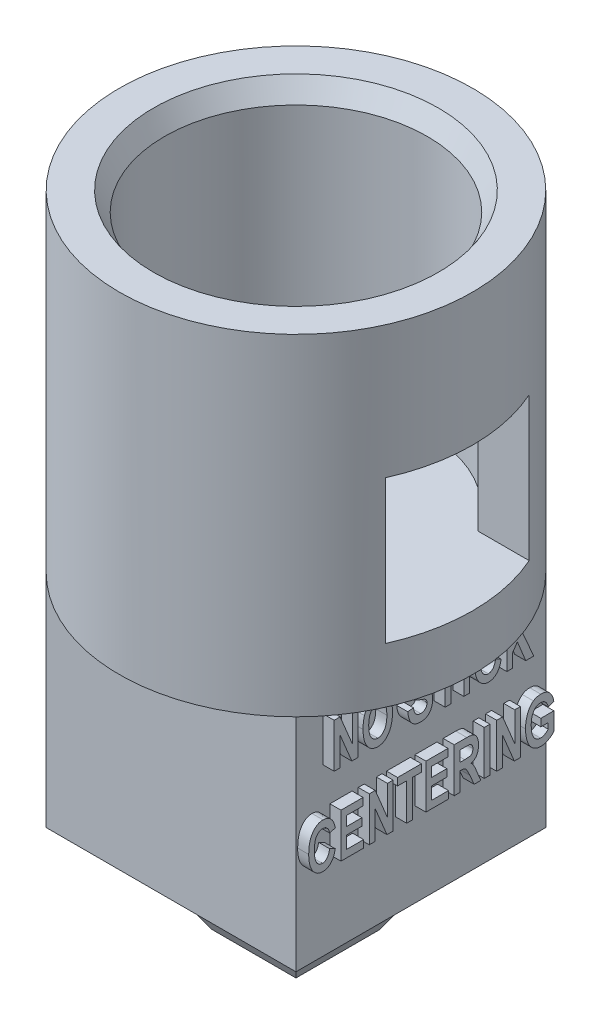
from build123d import *

# Parameters (mm, degrees)
SKETCH1_W           = 9.6
SKETCH1_H           = 9.6
BOSS_EXTRUDE1_DEPTH = 28
SKETCH2_R           = 16
BOSS_EXTRUDE2_DEPTH = 30
SKETCH3_R           = 11.9
CUT_EXTRUDE1_DEPTH  = 25
CHAMFER1_SIZE       = 1
CHAMFER1_SIZE2      = 1.732050808
CHAMFER2_SIZE       = 1
CHAMFER2_SIZE2      = 1.732050808
SKETCH4_W           = 22.627416998
SKETCH4_H           = 22.627416998
SKETCH4_W_2         = 15.5
SKETCH4_H_2         = 15.5
BOSS_EXTRUDE3_DEPTH = 20
SKETCH6_W           = 0.512820512
SKETCH6_H           = 4
BOSS_EXTRUDE4_DEPTH = 1
SKETCH7_W           = 0.512820513
SKETCH7_H           = 4
BOSS_EXTRUDE5_DEPTH = 1
SKETCH8_W           = 13
SKETCH8_H           = 13
CUT_EXTRUDE2_DEPTH  = 13
CHAMFER3_SIZE       = 4
CHAMFER3_SIZE2      = 4.76701437


with BuildPart() as part:
    # Sketch1 → Boss-Extrude1 (new body)
    with BuildSketch(Plane(origin=(0, 0, 0), x_dir=(1, 0, 0), z_dir=(0, 1, 0))):
        Rectangle(SKETCH1_W, SKETCH1_H)
    extrude(amount=BOSS_EXTRUDE1_DEPTH)

    # Sketch2 → Boss-Extrude2 (add)
    with BuildSketch(Plane(origin=(0, 28, 0), x_dir=(1, 0, 0), z_dir=(0, 1, 0))):
        with Locations(Location((0, 0, 0), (0, 0, 270))):
            Circle(SKETCH2_R)
    extrude(amount=BOSS_EXTRUDE2_DEPTH)

    # Sketch3 → Cut-Extrude1 (cut)
    with BuildSketch(Plane(origin=(0, 58, 0), x_dir=(1, 0, 0), z_dir=(0, 1, 0))):
        with Locations(Location((0, 0, 0), (0, 0, 270))):
            Circle(SKETCH3_R)
    extrude(amount=-CUT_EXTRUDE1_DEPTH, mode=Mode.SUBTRACT)

    # Chamfer1
    chamfer1_edges = [part.edges().sort_by_distance(p)[0] for p in [
        (0, 0, -4.8),
        (4.8, 0, 0),
        (0, 0, 4.8),
        (-4.8, 0, 0),
    ]]
    chamfer1_side = [part.faces().sort_by_distance(p)[0] for p in [
        (0, 0, 0),
    ]]
    chamfer(chamfer1_edges, length=CHAMFER1_SIZE, length2=CHAMFER1_SIZE2, reference=chamfer1_side[0])

    # Chamfer2
    chamfer2_edges = [part.edges().sort_by_distance(p)[0] for p in [
        (0, 58, -11.9),
    ]]
    chamfer2_side = [part.faces().sort_by_distance(p)[0] for p in [
        (0, 58, -15.54745166),
    ]]
    chamfer(chamfer2_edges, length=CHAMFER2_SIZE, length2=CHAMFER2_SIZE2, reference=chamfer2_side[0])

    # Sketch4 → Boss-Extrude3 (add)
    with BuildSketch(Plane.XZ.offset(-28)):
        Rectangle(SKETCH4_W, SKETCH4_H)
        Rectangle(SKETCH4_W_2, SKETCH4_H_2, mode=Mode.SUBTRACT)
    extrude(amount=BOSS_EXTRUDE3_DEPTH)

    # Sketch6 → Boss-Extrude4 (add)
    # profile 1 of 17: a face of its own
    with BuildSketch(Plane.ZY.offset(11.313708499)):
        with BuildLine():
            Line((-10.903452089, 23), (-10.903452089, 27))
            Line((-10.903452089, 27), (-9.338548243, 27))
            add(Edge.make_bspline(
                [(-9.338548243, 27), (-9.301953586, 26.999683502), (-9.231134406, 26.999071005), (-9.12817592, 26.994622782), (-9.03205443, 26.985280074), (-8.942314742, 26.974872789), (-8.85970653, 26.959478422), (-8.783957524, 26.941151993), (-8.714822747, 26.919639161), (-8.651528328, 26.894635046), (-8.592780586, 26.865620395), (-8.538346472, 26.830808982), (-8.486513932, 26.791522348), (-8.438574379, 26.746098406), (-8.392777923, 26.696526658), (-8.349973209, 26.64170466), (-8.311043485, 26.581253664), (-8.261937017, 26.495089203), (-8.210282075, 26.379705404), (-8.166485789, 26.233175593), (-8.139030336, 26.079551034), (-8.135841832, 25.97474204), (-8.134221319, 25.921474359)],
                knots=[0, 0, 0, 0, 1.180324108, 2.284201946, 3.322286431, 4.29462867, 5.196901233, 6.030560013, 6.80706835, 7.530129348, 8.223590187, 8.91667637, 9.611046246, 10.318072396, 11.043592444, 11.786297711, 12.558060821, 13.36051314, 14.983922772, 16.621804664, 18.28308027, 20, 20, 20, 20], degree=3))
            add(Edge.make_bspline(
                [(-8.134221319, 25.921474359), (-8.135127496, 25.887266232), (-8.13691567, 25.819762753), (-8.146954397, 25.720501037), (-8.165668631, 25.625426647), (-8.191238186, 25.534509462), (-8.224242428, 25.447652565), (-8.26414439, 25.364855547), (-8.312223425, 25.28667452), (-8.366147589, 25.211825419), (-8.429003624, 25.143061299), (-8.498946708, 25.07961543), (-8.57812348, 25.024721958), (-8.664579661, 24.975640228), (-8.758433482, 24.93212743), (-8.86070517, 24.896225404), (-8.971003764, 24.867545002), (-9.047581832, 24.853416433), (-9.086945678, 24.846153846)],
                knots=[0, 0, 0, 0, 1.035001246, 2.042385546, 3.013742417, 3.962661506, 4.896042824, 5.821134124, 6.738465555, 7.669325541, 8.607416091, 9.551507097, 10.519902302, 11.515061601, 12.556225869, 13.644870113, 14.7893796, 16, 16, 16, 16], degree=3))
            add(Edge.make_bspline(
                [(-9.086945678, 24.846153846), (-9.057095278, 24.830216929), (-9.000239313, 24.799861932), (-8.922441574, 24.751134109), (-8.856056361, 24.702537613), (-8.817985706, 24.6677825), (-8.800086704, 24.651442308)],
                knots=[0, 0, 0, 0, 1.166995455, 2.222772637, 3.164432654, 4, 4, 4, 4], degree=3))
            add(Edge.make_bspline(
                [(-8.800086704, 24.651442308), (-8.76515163, 24.614688112), (-8.6931614, 24.538949243), (-8.596156236, 24.408707067), (-8.500805329, 24.264007383), (-8.44454129, 24.158618167), (-8.415471319, 24.104166667)],
                knots=[0, 0, 0, 0, 0.905527982, 1.866009172, 2.897429859, 4, 4, 4, 4], degree=3))
            Line((-8.415471319, 24.104166667), (-7.824125166, 23))
            Line((-7.824125166, 23), (-8.420279012, 23))
            Line((-8.420279012, 23), (-8.867394396, 23.844551282))
            add(Edge.make_bspline(
                [(-8.867394396, 23.844551282), (-8.883408953, 23.874204171), (-8.914475698, 23.931728006), (-8.95987715, 24.015367417), (-9.004368045, 24.092554397), (-9.044843628, 24.165627777), (-9.085230787, 24.232012427), (-9.121645764, 24.294306616), (-9.157322103, 24.350249732), (-9.199494712, 24.416671769), (-9.249101423, 24.489659737), (-9.307521478, 24.564249903), (-9.361795652, 24.625100218), (-9.430114037, 24.683264856), (-9.514338928, 24.738613869), (-9.587135512, 24.76414419), (-9.622202089, 24.776442308)],
                knots=[0, 0, 0, 0, 1.151361241, 2.233533264, 3.251027285, 4.194954736, 5.086954017, 5.905398939, 6.659843725, 7.353393472, 8.593603245, 9.672423153, 10.589460707, 11.372340066, 12.734239498, 14, 14, 14, 14], degree=3))
            add(Edge.make_bspline(
                [(-9.622202089, 24.776442308), (-9.636855164, 24.779368654), (-9.669948307, 24.78597764), (-9.726576958, 24.790521364), (-9.794939319, 24.795040619), (-9.844679187, 24.794930795), (-9.871400807, 24.794871795)],
                knots=[0, 0, 0, 0, 0.715768383, 1.616522439, 2.719530574, 4, 4, 4, 4], degree=3))
            Line((-9.871400807, 24.794871795), (-10.390631576, 24.794871795))
            Line((-10.390631576, 24.794871795), (-10.390631576, 23))
            Line((-10.390631576, 23), (-10.903452089, 23))
        make_face()
        with BuildLine():
            Line((-10.390631576, 25.256410256), (-9.428291832, 25.256410256))
            add(Edge.make_bspline(
                [(-9.428291832, 25.256410256), (-9.380178879, 25.257264552), (-9.290144457, 25.258863207), (-9.164592238, 25.272110154), (-9.057689142, 25.293757373), (-8.967317515, 25.324951872), (-8.891272436, 25.367869595), (-8.826127725, 25.421525795), (-8.771084161, 25.486571618), (-8.726919692, 25.561639042), (-8.690860176, 25.642807035), (-8.665487677, 25.728758058), (-8.649473729, 25.818044004), (-8.647860827, 25.878670412), (-8.647041832, 25.909455128)],
                knots=[0, 0, 0, 0, 1.479640641, 2.768871598, 3.877468672, 4.828571367, 5.696792412, 6.548848144, 7.411453614, 8.303335614, 9.219262273, 10.136808739, 11.053913723, 12, 12, 12, 12], degree=3))
            add(Edge.make_bspline(
                [(-8.647041832, 25.909455128), (-8.647385053, 25.931922761), (-8.648057486, 25.975940923), (-8.656802164, 26.040128535), (-8.668355729, 26.101676525), (-8.685769457, 26.160095619), (-8.709612245, 26.215069104), (-8.737469984, 26.267272832), (-8.770565576, 26.316339432), (-8.808271321, 26.362323101), (-8.851509772, 26.404524579), (-8.901555338, 26.440223439), (-8.956733862, 26.471295556), (-9.018190176, 26.495987101), (-9.085641976, 26.515100786), (-9.158939119, 26.528205259), (-9.237609438, 26.537664402), (-9.29204301, 26.538190294), (-9.320118755, 26.538461538)],
                knots=[0, 0, 0, 0, 1.027660944, 2.013373859, 2.960495112, 3.892662553, 4.796496922, 5.699090044, 6.597699653, 7.500954986, 8.417517152, 9.354163886, 10.306557675, 11.310080009, 12.378182552, 13.510020315, 14.715718406, 16, 16, 16, 16], degree=3))
            Line((-9.320118755, 26.538461538), (-10.390631576, 26.538461538))
            Line((-10.390631576, 26.538461538), (-10.390631576, 25.256410256))
        make_face(mode=Mode.SUBTRACT)
    # profile 2 of 17: a face of its own
    with BuildSketch(Plane.ZY.offset(11.313708499)):
        Polygon((-7.313708499, 23), (-7.313708499, 27), (-4.749605935, 27), (-4.749605935, 26.538461538), (-6.800887986, 26.538461538), (-6.800887986, 25.307692308), (-4.903452089, 25.307692308), (-4.903452089, 24.846153846), (-6.800887986, 24.846153846), (-6.800887986, 23.461538462), (-4.647041832, 23.461538462), (-4.647041832, 23), align=None)
    # profile 3 of 17: a face of its own
    with BuildSketch(Plane.ZY.offset(11.313708499)):
        with BuildLine():
            Line((-4.031657217, 23), (-4.031657217, 27))
            Line((-4.031657217, 27), (-3.264830294, 27))
            Line((-3.264830294, 27), (-2.473163627, 24.193108974))
            add(Edge.make_bspline(
                [(-2.473163627, 24.193108974), (-2.46426405, 24.16134828), (-2.447078061, 24.100015141), (-2.423565911, 24.010780641), (-2.399924903, 23.928509122), (-2.378846965, 23.852181084), (-2.361080867, 23.781615049), (-2.342912183, 23.717801146), (-2.327841306, 23.659728004), (-2.318255248, 23.623128627), (-2.313708499, 23.605769231)],
                knots=[0, 0, 0, 0, 1.300676304, 2.511738533, 3.638772616, 4.676163814, 5.634164497, 6.508050407, 7.292355584, 8, 8, 8, 8], degree=3))
            add(Edge.make_bspline(
                [(-2.313708499, 23.605769231), (-2.308925238, 23.62473903), (-2.298740668, 23.665129728), (-2.282137875, 23.72876241), (-2.262543728, 23.79857014), (-2.241824132, 23.874723051), (-2.219317104, 23.95723587), (-2.195468961, 24.046302887), (-2.168961903, 24.141640225), (-2.15028248, 24.207275039), (-2.140631576, 24.241185897)],
                knots=[0, 0, 0, 0, 0.712931652, 1.517981605, 2.396414474, 3.355089217, 4.394009158, 5.513176905, 6.715158881, 8, 8, 8, 8], degree=3))
            Line((-2.140631576, 24.241185897), (-1.361785422, 27))
            Line((-1.361785422, 27), (-0.595759781, 27))
            Line((-0.595759781, 27), (-0.595759781, 23))
            Line((-0.595759781, 23), (-1.108580294, 23))
            Line((-1.108580294, 23), (-1.108580294, 26.384615385))
            Line((-1.108580294, 26.384615385), (-2.04848414, 23))
            Line((-2.04848414, 23), (-2.57973414, 23))
            Line((-2.57973414, 23), (-3.518836704, 26.384615385))
            Line((-3.518836704, 26.384615385), (-3.518836704, 23))
            Line((-3.518836704, 23), (-4.031657217, 23))
        make_face()
    # profile 4 of 17: a face of its own
    with BuildSketch(Plane.ZY.offset(11.313708499)):
        with BuildLine():
            add(Edge.make_bspline(
                [(0.019624834, 24.947115385), (0.020958657, 25.027289963), (0.023555865, 25.183405161), (0.045145834, 25.410860048), (0.082121953, 25.624487116), (0.132002576, 25.825308135), (0.197809748, 26.012527729), (0.277924341, 26.186634922), (0.373094711, 26.347125131), (0.481564569, 26.493778065), (0.602814705, 26.623947242), (0.73204472, 26.738968919), (0.870784583, 26.835852706), (1.018228365, 26.914751745), (1.17392517, 26.976154588), (1.338021962, 27.019122379), (1.510424643, 27.046547128), (1.628493267, 27.049683066), (1.688695347, 27.051282051)],
                knots=[0, 0, 0, 0, 1.274097692, 2.480911245, 3.62686337, 4.71719691, 5.765766647, 6.776203283, 7.758323085, 8.726211193, 9.669441384, 10.580750943, 11.471045033, 12.352275481, 13.232810372, 14.124530334, 15.043715675, 16, 16, 16, 16], degree=3))
            add(Edge.make_bspline(
                [(1.688695347, 27.051282051), (1.728519318, 27.050508952), (1.807283057, 27.048979917), (1.923876105, 27.036898897), (2.037330312, 27.015734463), (2.147816864, 26.987252693), (2.255245693, 26.949638726), (2.360218461, 26.905474763), (2.461487997, 26.850860932), (2.559783092, 26.789741018), (2.653449211, 26.720467317), (2.742528234, 26.645480916), (2.825356877, 26.563503656), (2.90154069, 26.474571039), (2.973157123, 26.380289759), (3.038244995, 26.278606461), (3.097217087, 26.170498481), (3.150902342, 26.056483555), (3.19889063, 25.937820317), (3.239682058, 25.814261075), (3.274832206, 25.687270974), (3.3041719, 25.556061195), (3.325044042, 25.420782537), (3.34138662, 25.281838031), (3.351150559, 25.139029339), (3.352350497, 25.042482711), (3.352958168, 24.993589744)],
                knots=[0, 0, 0, 0, 0.966523865, 1.911588243, 2.841114784, 3.765722261, 4.678088802, 5.601718424, 6.526893946, 7.467679169, 8.409067324, 9.352061412, 10.29184089, 11.234121568, 12.192325506, 13.163426325, 14.161506116, 15.179433539, 16.220791871, 17.266359438, 18.335911805, 19.418121576, 20.527658124, 21.656702398, 22.813311488, 24, 24, 24, 24], degree=3))
            add(Edge.make_bspline(
                [(3.352958168, 24.993589744), (3.352429153, 24.943890358), (3.351384137, 24.845714219), (3.340495644, 24.700797977), (3.323772459, 24.559874477), (3.300536632, 24.422950358), (3.271196046, 24.289588053), (3.234006927, 24.160527579), (3.191020707, 24.035096915), (3.140433081, 23.914645415), (3.084734653, 23.799360525), (3.023122669, 23.690600216), (2.954705065, 23.589835048), (2.881807953, 23.495488038), (2.803030633, 23.408694065), (2.718673184, 23.329088923), (2.628656414, 23.256729937), (2.533639509, 23.192162554), (2.434826718, 23.135360087), (2.333687148, 23.085477877), (2.230634511, 23.043147093), (2.125550661, 23.008016991), (2.018466056, 22.982192084), (1.909643391, 22.962452288), (1.798708324, 22.9512146), (1.723975698, 22.949554872), (1.686291501, 22.948717949)],
                knots=[0, 0, 0, 0, 1.209807467, 2.389853036, 3.536013918, 4.663876702, 5.769837152, 6.858688728, 7.932188863, 8.996153267, 10.037338607, 11.047980843, 12.036347995, 13.000216837, 13.948561575, 14.887000136, 15.821329157, 16.757421618, 17.680961941, 18.594141893, 19.501048814, 20.391462789, 21.288877948, 22.180525842, 23.082523577, 24, 24, 24, 24], degree=3))
            add(Edge.make_bspline(
                [(1.686291501, 22.948717949), (1.645923459, 22.949404243), (1.565780649, 22.950766746), (1.447449815, 22.964185094), (1.332167244, 22.984676761), (1.220202983, 23.014628528), (1.111448118, 23.052985155), (1.006010121, 23.099812883), (0.903735674, 23.154346861), (0.805633371, 23.217636975), (0.711911222, 23.288079374), (0.623584714, 23.365251341), (0.540785952, 23.44853026), (0.464749028, 23.538723795), (0.394162873, 23.634308372), (0.328537582, 23.735553104), (0.270670272, 23.844008286), (0.217720788, 23.957342673), (0.171952321, 24.074907729), (0.13074006, 24.194234577), (0.096164344, 24.315661824), (0.068340753, 24.438744186), (0.046379008, 24.563605031), (0.031691765, 24.689908495), (0.021356961, 24.817938902), (0.020205311, 24.903825285), (0.019624834, 24.947115385)],
                knots=[0, 0, 0, 0, 0.999232255, 1.98377917, 2.945059149, 3.896390443, 4.850247299, 5.79777763, 6.750556201, 7.717394396, 8.68565669, 9.651272558, 10.61935413, 11.590683551, 12.569549377, 13.5602306, 14.575272275, 15.610919321, 16.656089227, 17.697674641, 18.736063452, 19.780563512, 20.821140533, 21.873650616, 22.928236657, 24, 24, 24, 24], degree=3))
        make_face()
        with BuildLine():
            add(Edge.make_bspline(
                [(0.532445347, 24.940705128), (0.533163888, 24.882969729), (0.534564041, 24.770466154), (0.551363625, 24.606409735), (0.576643128, 24.451640745), (0.611268185, 24.305753409), (0.65819792, 24.170055133), (0.714023, 24.043350321), (0.781053778, 23.926386986), (0.857605642, 23.819270113), (0.942391477, 23.723654569), (1.032084879, 23.639161575), (1.128438788, 23.569343909), (1.229041359, 23.510732783), (1.335461617, 23.465766878), (1.447048522, 23.433555115), (1.563795659, 23.413814439), (1.643479395, 23.411453607), (1.683887655, 23.41025641)],
                knots=[0, 0, 0, 0, 1.292304231, 2.518192475, 3.688203032, 4.802214062, 5.870798834, 6.898850454, 7.898055377, 8.8838906, 9.841456472, 10.755527506, 11.63713118, 12.499849723, 13.357391098, 14.216682474, 15.095665435, 16, 16, 16, 16], degree=3))
            add(Edge.make_bspline(
                [(1.683887655, 23.41025641), (1.725090396, 23.411464269), (1.806090097, 23.413838777), (1.924860866, 23.433308009), (2.037521533, 23.466683733), (2.145337341, 23.511376064), (2.246425901, 23.570797695), (2.34288927, 23.641630832), (2.432577586, 23.726670115), (2.516815968, 23.823455715), (2.59268142, 23.932577467), (2.659667587, 24.052633701), (2.715551931, 24.183828626), (2.76104952, 24.325828435), (2.797148794, 24.478505181), (2.822257041, 24.642209812), (2.8377574, 24.816471886), (2.839329903, 24.936130709), (2.840137655, 24.997596154)],
                knots=[0, 0, 0, 0, 0.897469134, 1.764317854, 2.61332161, 3.453180069, 4.300666463, 5.162027503, 6.055506142, 6.987885588, 7.953370966, 8.945996531, 9.978413341, 11.055090065, 12.191456826, 13.393229137, 14.660973547, 16, 16, 16, 16], degree=3))
            add(Edge.make_bspline(
                [(2.840137655, 24.997596154), (2.838439348, 25.075118745), (2.835138313, 25.225801028), (2.809851543, 25.444305031), (2.765690873, 25.647363115), (2.714643289, 25.805616051), (2.665270447, 25.92327052), (2.62419931, 26.005383076), (2.57928857, 26.082502489), (2.530549752, 26.154710493), (2.477381929, 26.221827356), (2.419524274, 26.283183203), (2.358515115, 26.340538832), (2.293694952, 26.39252198), (2.225904821, 26.438862841), (2.155608202, 26.479072294), (2.083671059, 26.514091665), (2.008722088, 26.540865757), (1.932200493, 26.562709573), (1.85381659, 26.579064768), (1.77302492, 26.587685972), (1.718628053, 26.589052184), (1.691099193, 26.58974359)],
                knots=[0, 0, 0, 0, 2.115911222, 4.11274097, 5.993324997, 7.780215686, 8.642806296, 9.47426833, 10.284587078, 11.077297109, 11.850452832, 12.619057295, 13.377356604, 14.134568543, 14.884833599, 15.616444918, 16.343683582, 17.065640104, 17.785716576, 18.514962628, 19.248460668, 20, 20, 20, 20], degree=3))
            add(Edge.make_bspline(
                [(1.691099193, 26.58974359), (1.652291978, 26.588821566), (1.575293809, 26.586992161), (1.462255031, 26.567642958), (1.353247666, 26.537961337), (1.248102781, 26.497043902), (1.147646333, 26.443001276), (1.051942402, 26.376267685), (0.959419336, 26.299345255), (0.871660742, 26.210109882), (0.790238483, 26.106979715), (0.720997744, 25.986645176), (0.662516566, 25.850707294), (0.614846979, 25.699214627), (0.577301231, 25.531979733), (0.551757185, 25.34893389), (0.535474591, 25.150133842), (0.533481219, 25.012320776), (0.532445347, 24.940705128)],
                knots=[0, 0, 0, 0, 0.819474858, 1.625936374, 2.416112125, 3.204410419, 4.005002645, 4.820794539, 5.666430121, 6.544618678, 7.46154083, 8.435524248, 9.469541593, 10.583534496, 11.787291839, 13.087757725, 14.486630308, 16, 16, 16, 16], degree=3))
        make_face(mode=Mode.SUBTRACT)
    # profile 5 of 17: a face of its own
    with BuildSketch(Plane.ZY.offset(11.313708499)):
        with BuildLine():
            Line((5.050073552, 23), (3.614977398, 27))
            Line((3.614977398, 27), (4.173470988, 27))
            Line((4.173470988, 27), (5.133406886, 24.133012821))
            add(Edge.make_bspline(
                [(5.133406886, 24.133012821), (5.152362111, 24.076471829), (5.189444653, 23.965859395), (5.239746873, 23.801348167), (5.28659202, 23.642920756), (5.313958079, 23.5382673), (5.327317142, 23.487179487)],
                knots=[0, 0, 0, 0, 1.060939515, 2.075540223, 3.060552378, 4, 4, 4, 4], degree=3))
            add(Edge.make_bspline(
                [(5.327317142, 23.487179487), (5.355933062, 23.595124122), (5.413495694, 23.8122612), (5.483580016, 24.025686787), (5.518823552, 24.133012821)],
                knots=[0, 0, 0, 0, 0.994253367, 2, 2, 2, 2], degree=3))
            Line((5.518823552, 24.133012821), (6.481163296, 27))
            Line((6.481163296, 27), (7.039656886, 27))
            Line((7.039656886, 27), (5.658246629, 23))
            Line((5.658246629, 23), (5.050073552, 23))
        make_face()
    # profile 6 of 17: a face of its own
    with BuildSketch(Plane.ZY.offset(11.313708499)):
        Polygon((7.404240219, 23), (7.404240219, 27), (9.968342783, 27), (9.968342783, 26.538461538), (7.917060732, 26.538461538), (7.917060732, 25.307692308), (9.814496629, 25.307692308), (9.814496629, 24.846153846), (7.917060732, 24.846153846), (7.917060732, 23.461538462), (10.070906886, 23.461538462), (10.070906886, 23), align=None)
    # profile 7 of 17: a face of its own
    with BuildSketch(Plane.ZY.offset(11.313708499)):
        Polygon((-8.628612345, 15.846153846), (-7.215952089, 19.846153846), (-6.640631576, 19.846153846), (-5.228772602, 15.846153846), (-5.775246961, 15.846153846), (-6.176689268, 17.076923077), (-7.681496961, 17.076923077), (-8.082939268, 15.846153846), align=None)
        with BuildLine():
            Line((-7.530855935, 17.538461538), (-6.327330294, 17.538461538))
            Line((-6.327330294, 17.538461538), (-6.666272602, 18.579326923))
            add(Edge.make_bspline(
                [(-6.666272602, 18.579326923), (-6.679669516, 18.620178554), (-6.705752919, 18.699715494), (-6.743137236, 18.816078451), (-6.779490676, 18.925670298), (-6.812977258, 19.02944472), (-6.845207728, 19.126788293), (-6.874528383, 19.218328586), (-6.902993693, 19.303306764), (-6.920599719, 19.358155556), (-6.929093114, 19.384615385)],
                knots=[0, 0, 0, 0, 1.218062451, 2.371532236, 3.462754579, 4.4893803, 5.460953514, 6.367932125, 7.212667493, 8, 8, 8, 8], degree=3))
            add(Edge.make_bspline(
                [(-6.929093114, 19.384615385), (-6.968579837, 19.263340586), (-7.048442045, 19.018061354), (-7.128834282, 18.772955328), (-7.16947773, 18.649038462)],
                knots=[0, 0, 0, 0, 0.988871312, 2, 2, 2, 2], degree=3))
            Line((-7.16947773, 18.649038462), (-7.530855935, 17.538461538))
        make_face(mode=Mode.SUBTRACT)
    # profile 8 of 17: a face of its own
    with BuildSketch(Plane.ZY.offset(11.313708499)):
        Polygon((-4.800887986, 15.846153846), (-4.800887986, 19.846153846), (-2.441913627, 19.846153846), (-2.441913627, 19.384615385), (-4.288067473, 19.384615385), (-4.288067473, 18.102564103), (-2.749605935, 18.102564103), (-2.749605935, 17.641025641), (-4.288067473, 17.641025641), (-4.288067473, 15.846153846), align=None)
    # profile 9 of 17: a face of its own
    with BuildSketch(Plane.ZY.offset(11.313708499)):
        Polygon((-0.903452089, 15.846153846), (-0.903452089, 19.384615385), (-2.082939268, 19.384615385), (-2.082939268, 19.846153846), (0.788855604, 19.846153846), (0.788855604, 19.384615385), (-0.390631576, 19.384615385), (-0.390631576, 15.846153846), align=None)
    # profile 10 of 17: a face of its own
    with BuildSketch(Plane.ZY.offset(11.313708499)):
        Polygon((1.250394065, 15.846153846), (1.250394065, 19.846153846), (3.814496629, 19.846153846), (3.814496629, 19.384615385), (1.763214578, 19.384615385), (1.763214578, 18.153846154), (3.660650475, 18.153846154), (3.660650475, 17.692307692), (1.763214578, 17.692307692), (1.763214578, 16.307692308), (3.917060732, 16.307692308), (3.917060732, 15.846153846), align=None)
    # profile 11 of 17: a face of its own
    with BuildSketch(Plane.ZY.offset(11.313708499)):
        with BuildLine():
            Line((4.583727398, 15.846153846), (4.583727398, 19.846153846))
            Line((4.583727398, 19.846153846), (6.148631245, 19.846153846))
            add(Edge.make_bspline(
                [(6.148631245, 19.846153846), (6.185225901, 19.845837348), (6.256045081, 19.845224851), (6.359003567, 19.840776628), (6.455125058, 19.831433921), (6.544864745, 19.821026635), (6.627472957, 19.805632268), (6.703221963, 19.787305839), (6.77235674, 19.765793007), (6.83565116, 19.740788892), (6.894398901, 19.711774241), (6.948833015, 19.676962828), (7.000665555, 19.637676195), (7.048605108, 19.592252252), (7.094401564, 19.542680504), (7.137206278, 19.487858506), (7.176136002, 19.42740751), (7.22524247, 19.341243049), (7.276897412, 19.22585925), (7.320693698, 19.079329439), (7.348149151, 18.92570488), (7.351337656, 18.820895886), (7.352958168, 18.767628205)],
                knots=[0, 0, 0, 0, 1.180324108, 2.284201946, 3.322286431, 4.29462867, 5.196901233, 6.030560013, 6.80706835, 7.530129348, 8.223590187, 8.91667637, 9.611046246, 10.318072396, 11.043592444, 11.786297711, 12.558060821, 13.36051314, 14.983922772, 16.621804664, 18.28308027, 20, 20, 20, 20], degree=3))
            add(Edge.make_bspline(
                [(7.352958168, 18.767628205), (7.352051991, 18.733420078), (7.350263817, 18.665916599), (7.34022509, 18.566654883), (7.321510856, 18.471580494), (7.295941301, 18.380663308), (7.26293706, 18.293806411), (7.223035097, 18.211009393), (7.174956063, 18.132828366), (7.121031898, 18.057979265), (7.058175863, 17.989215145), (6.988232779, 17.925769276), (6.909056007, 17.870875804), (6.822599826, 17.821794074), (6.728746006, 17.778281276), (6.626474318, 17.74237925), (6.516175724, 17.713698848), (6.439597655, 17.699570279), (6.400233809, 17.692307692)],
                knots=[0, 0, 0, 0, 1.035001246, 2.042385546, 3.013742417, 3.962661506, 4.896042824, 5.821134124, 6.738465555, 7.669325541, 8.607416091, 9.551507097, 10.519902302, 11.515061601, 12.556225869, 13.644870113, 14.7893796, 16, 16, 16, 16], degree=3))
            add(Edge.make_bspline(
                [(6.400233809, 17.692307692), (6.430084209, 17.676370775), (6.486940174, 17.646015778), (6.564737914, 17.597287955), (6.631123126, 17.548691459), (6.669193781, 17.513936346), (6.687092783, 17.497596154)],
                knots=[0, 0, 0, 0, 1.166995455, 2.222772637, 3.164432654, 4, 4, 4, 4], degree=3))
            add(Edge.make_bspline(
                [(6.687092783, 17.497596154), (6.722027857, 17.460841959), (6.794018087, 17.385103089), (6.891023252, 17.254860914), (6.986374158, 17.110161229), (7.042638197, 17.004772013), (7.071708168, 16.950320513)],
                knots=[0, 0, 0, 0, 0.905527982, 1.866009172, 2.897429859, 4, 4, 4, 4], degree=3))
            Line((7.071708168, 16.950320513), (7.663054322, 15.846153846))
            Line((7.663054322, 15.846153846), (7.066900475, 15.846153846))
            Line((7.066900475, 15.846153846), (6.619785091, 16.690705128))
            add(Edge.make_bspline(
                [(6.619785091, 16.690705128), (6.603770534, 16.720358017), (6.572703789, 16.777881853), (6.527302338, 16.861521263), (6.482811442, 16.938708243), (6.442335859, 17.011781623), (6.401948701, 17.078166273), (6.365533723, 17.140460463), (6.329857384, 17.196403578), (6.287684775, 17.262825616), (6.238078064, 17.335813583), (6.17965801, 17.410403749), (6.125383835, 17.471254065), (6.05706545, 17.529418702), (5.972840559, 17.584767715), (5.900043976, 17.610298036), (5.864977398, 17.622596154)],
                knots=[0, 0, 0, 0, 1.151361241, 2.233533264, 3.251027285, 4.194954736, 5.086954017, 5.905398939, 6.659843725, 7.353393472, 8.593603245, 9.672423153, 10.589460707, 11.372340066, 12.734239498, 14, 14, 14, 14], degree=3))
            add(Edge.make_bspline(
                [(5.864977398, 17.622596154), (5.850324323, 17.6255225), (5.81723118, 17.632131486), (5.760602529, 17.636675211), (5.692240169, 17.641194465), (5.6425003, 17.641084641), (5.615778681, 17.641025641)],
                knots=[0, 0, 0, 0, 0.715768383, 1.616522439, 2.719530574, 4, 4, 4, 4], degree=3))
            Line((5.615778681, 17.641025641), (5.096547911, 17.641025641))
            Line((5.096547911, 17.641025641), (5.096547911, 15.846153846))
            Line((5.096547911, 15.846153846), (4.583727398, 15.846153846))
        make_face()
        with BuildLine():
            Line((5.096547911, 18.102564103), (6.058887655, 18.102564103))
            add(Edge.make_bspline(
                [(6.058887655, 18.102564103), (6.107000608, 18.103418398), (6.19703503, 18.105017053), (6.322587249, 18.118264), (6.429490345, 18.139911219), (6.519861972, 18.171105718), (6.595907051, 18.214023441), (6.661051763, 18.267679641), (6.716095326, 18.332725464), (6.760259795, 18.407792888), (6.796319311, 18.488960881), (6.821691811, 18.574911904), (6.837705759, 18.66419785), (6.83931866, 18.724824259), (6.840137655, 18.755608974)],
                knots=[0, 0, 0, 0, 1.479640641, 2.768871598, 3.877468672, 4.828571367, 5.696792412, 6.548848144, 7.411453614, 8.303335614, 9.219262273, 10.136808739, 11.053913723, 12, 12, 12, 12], degree=3))
            add(Edge.make_bspline(
                [(6.840137655, 18.755608974), (6.839794434, 18.778076608), (6.839122001, 18.822094769), (6.830377323, 18.886282382), (6.818823758, 18.947830372), (6.80141003, 19.006249466), (6.777567242, 19.06122295), (6.749709503, 19.113426678), (6.716613911, 19.162493278), (6.678908166, 19.208476947), (6.635669716, 19.250678426), (6.58562415, 19.286377285), (6.530445625, 19.317449402), (6.468989311, 19.342140947), (6.401537512, 19.361254633), (6.328240369, 19.374359105), (6.249570049, 19.383818249), (6.195136477, 19.38434414), (6.167060732, 19.384615385)],
                knots=[0, 0, 0, 0, 1.027660944, 2.013373859, 2.960495112, 3.892662553, 4.796496922, 5.699090044, 6.597699653, 7.500954986, 8.417517152, 9.354163886, 10.306557675, 11.310080009, 12.378182552, 13.510020315, 14.715718406, 16, 16, 16, 16], degree=3))
            Line((6.167060732, 19.384615385), (5.096547911, 19.384615385))
            Line((5.096547911, 19.384615385), (5.096547911, 18.102564103))
        make_face(mode=Mode.SUBTRACT)
    # profile 12 of 17: a face of its own
    with BuildSketch(Plane.ZY.offset(11.313708499)):
        Polygon((-8.134221319, 8.692307692), (-8.134221319, 12.692307692), (-5.775246961, 12.692307692), (-5.775246961, 12.230769231), (-7.621400807, 12.230769231), (-7.621400807, 10.948717949), (-6.082939268, 10.948717949), (-6.082939268, 10.487179487), (-7.621400807, 10.487179487), (-7.621400807, 8.692307692), align=None)
    # profile 13 of 17: a face of its own
    with BuildSketch(Plane.ZY.offset(11.313708499)):
        Polygon((-5.108580294, 8.692307692), (-5.108580294, 12.692307692), (-4.595759781, 12.692307692), (-4.595759781, 9.153846154), (-2.903452089, 9.153846154), (-2.903452089, 8.692307692), align=None)
    # profile 14 of 17: a face of its own
    with BuildSketch(Plane.ZY.offset(11.313708499)):
        with Locations((-2.031657217, 10.692307692)):
            Rectangle(SKETCH6_W, SKETCH6_H)
    # profile 15 of 17: a face of its own
    with BuildSketch(Plane.ZY.offset(11.313708499)):
        with BuildLine():
            Line((0.686291501, 10.282051282), (0.686291501, 10.743589744))
            Line((0.686291501, 10.743589744), (2.173470988, 10.743589744))
            Line((2.173470988, 10.743589744), (2.173470988, 9.263621795))
            add(Edge.make_bspline(
                [(2.173470988, 9.263621795), (2.1159449, 9.214407579), (2.003263095, 9.118007028), (1.825845391, 8.99107681), (1.645319637, 8.883839179), (1.462573346, 8.794939657), (1.276471577, 8.726448277), (1.087857436, 8.677394131), (0.896720405, 8.646391508), (0.768136804, 8.642812877), (0.703919706, 8.641025641)],
                knots=[0, 0, 0, 0, 1.112363294, 2.178891477, 3.201601167, 4.195413197, 5.161721217, 6.111061667, 7.05662823, 8, 8, 8, 8], degree=3))
            add(Edge.make_bspline(
                [(0.703919706, 8.641025641), (0.66088718, 8.641769652), (0.575454532, 8.643246739), (0.449180863, 8.655819703), (0.325722236, 8.674774282), (0.205283615, 8.702225321), (0.087598609, 8.737127983), (-0.026659051, 8.781076963), (-0.138272465, 8.831316664), (-0.246405547, 8.889628589), (-0.349331554, 8.956068654), (-0.44686951, 9.029065762), (-0.537640743, 9.109523479), (-0.62186714, 9.196798076), (-0.699060989, 9.291471538), (-0.770745959, 9.392236404), (-0.834563348, 9.500896569), (-0.892197791, 9.615532445), (-0.943208762, 9.735203766), (-0.987266609, 9.859192651), (-1.025107944, 9.986429057), (-1.055227011, 10.117380698), (-1.079630903, 10.251283599), (-1.096008831, 10.38883882), (-1.107011549, 10.529734147), (-1.108053905, 10.62497854), (-1.108580294, 10.673076923)],
                knots=[0, 0, 0, 0, 1.009931783, 2.005021632, 2.976038321, 3.940372342, 4.902441252, 5.854962638, 6.811807606, 7.774060372, 8.735822777, 9.6850782, 10.631160269, 11.580084335, 12.528987688, 13.496191363, 14.480077752, 15.483899387, 16.506403338, 17.53169082, 18.571237996, 19.620627325, 20.684452155, 21.764650265, 22.871149201, 24, 24, 24, 24], degree=3))
            add(Edge.make_bspline(
                [(-1.108580294, 10.673076923), (-1.108057094, 10.720909194), (-1.107018189, 10.815888429), (-1.0958394, 10.957293233), (-1.079730792, 11.096482849), (-1.054865806, 11.232894687), (-1.026089447, 11.36727374), (-0.9877787, 11.498589902), (-0.943807946, 11.627794554), (-0.893574506, 11.753890979), (-0.837710082, 11.875171018), (-0.773675594, 11.988496385), (-0.705308782, 12.094468861), (-0.630084685, 12.192105361), (-0.549506207, 12.281934198), (-0.462405562, 12.363145693), (-0.369910844, 12.436639205), (-0.271245398, 12.501353572), (-0.167552891, 12.558063517), (-0.06014081, 12.608158805), (0.051541964, 12.649401426), (0.166685509, 12.684532837), (0.286042053, 12.71036901), (0.408788659, 12.729879742), (0.53543913, 12.741161757), (0.621098735, 12.742771291), (0.664656886, 12.743589744)],
                knots=[0, 0, 0, 0, 1.119537342, 2.223034738, 3.318923678, 4.398330795, 5.467876783, 6.534622596, 7.598450614, 8.662039716, 9.711045232, 10.721647707, 11.706742524, 12.66099191, 13.6040102, 14.528605935, 15.445579817, 16.366468045, 17.28718643, 18.210406829, 19.138379324, 20.072085219, 21.026334605, 21.99471727, 22.980308081, 24, 24, 24, 24], degree=3))
            add(Edge.make_bspline(
                [(0.664656886, 12.743589744), (0.727240565, 12.741884009), (0.849745989, 12.738545091), (1.029085728, 12.712717282), (1.198766307, 12.668428829), (1.3585673, 12.607760248), (1.505237414, 12.531510196), (1.637376932, 12.44110082), (1.751614835, 12.33568607), (1.849669157, 12.215375291), (1.932703666, 12.078621918), (2.00567058, 11.924891812), (2.06721116, 11.751817534), (2.098128664, 11.628770368), (2.114176116, 11.564903846)],
                knots=[0, 0, 0, 0, 1.098227559, 2.14974307, 3.171986082, 4.170640085, 5.143599391, 6.066905801, 6.972632281, 7.862248491, 8.782096857, 9.773960334, 10.84459418, 12, 12, 12, 12], degree=3))
            Line((2.114176116, 11.564903846), (1.644624834, 11.435096154))
            add(Edge.make_bspline(
                [(1.644624834, 11.435096154), (1.631646709, 11.482567904), (1.606834227, 11.573327696), (1.56143697, 11.699544191), (1.511868707, 11.810154294), (1.456239135, 11.905882453), (1.391142147, 11.989577573), (1.31430676, 12.062715464), (1.225271093, 12.127156384), (1.125264128, 12.181871608), (1.016846175, 12.226770443), (0.901174826, 12.258814546), (0.779650442, 12.278527578), (0.696516354, 12.280863432), (0.654240219, 12.282051282)],
                knots=[0, 0, 0, 0, 1.239921697, 2.370568513, 3.376674919, 4.290999752, 5.154136589, 6.039661289, 6.955224205, 7.91632368, 8.906358951, 9.905891125, 10.935083876, 12, 12, 12, 12], degree=3))
            add(Edge.make_bspline(
                [(0.654240219, 12.282051282), (0.604231682, 12.280588735), (0.507003235, 12.277745196), (0.366285916, 12.258038343), (0.236058237, 12.223571881), (0.116867939, 12.175183296), (0.008932422, 12.115543697), (-0.089431037, 12.048339179), (-0.175407151, 11.970620722), (-0.250992075, 11.885327491), (-0.316232208, 11.793489642), (-0.374434647, 11.697788405), (-0.424477677, 11.59719928), (-0.451535807, 11.527206075), (-0.465150807, 11.491987179)],
                knots=[0, 0, 0, 0, 1.222720381, 2.377258167, 3.465614428, 4.508621589, 5.514085473, 6.476103001, 7.414963019, 8.340254289, 9.257396317, 10.165776199, 11.077062754, 12, 12, 12, 12], degree=3))
            add(Edge.make_bspline(
                [(-0.465150807, 11.491987179), (-0.485312964, 11.429811589), (-0.526027989, 11.304255543), (-0.565581626, 11.107612652), (-0.59162676, 10.903484085), (-0.594367519, 10.764507927), (-0.595759781, 10.693910256)],
                knots=[0, 0, 0, 0, 0.964745127, 1.948185507, 2.95771098, 4, 4, 4, 4], degree=3))
            add(Edge.make_bspline(
                [(-0.595759781, 10.693910256), (-0.595292003, 10.65063353), (-0.594375982, 10.565887427), (-0.5873786, 10.44124241), (-0.574108928, 10.322116777), (-0.557982032, 10.208013613), (-0.535311022, 10.099748819), (-0.508071221, 9.996755426), (-0.476199171, 9.899006949), (-0.439346632, 9.806626047), (-0.397700176, 9.719807227), (-0.351268654, 9.638996223), (-0.300676424, 9.563756873), (-0.244873652, 9.4948901), (-0.185965859, 9.430350332), (-0.121580319, 9.372353289), (-0.052045804, 9.32125571), (0.044248502, 9.259479762), (0.171992009, 9.197827563), (0.330395643, 9.142330563), (0.494233154, 9.109339682), (0.604951082, 9.104831869), (0.660650475, 9.102564103)],
                knots=[0, 0, 0, 0, 1.133231707, 2.219136686, 3.26724247, 4.2712005, 5.23549321, 6.161776954, 7.059744315, 7.926019917, 8.764373853, 9.57896399, 10.364605659, 11.13576204, 11.897953964, 12.650717411, 13.400485681, 14.155228508, 15.644108947, 17.10171164, 18.54194432, 20, 20, 20, 20], degree=3))
            add(Edge.make_bspline(
                [(0.660650475, 9.102564103), (0.709626269, 9.104389743), (0.807396101, 9.10803425), (0.953022104, 9.13357637), (1.096260933, 9.176632768), (1.234628587, 9.234682619), (1.363907311, 9.301695241), (1.478740531, 9.372801392), (1.578891933, 9.444089722), (1.634266429, 9.498238451), (1.660650475, 9.524038462)],
                knots=[0, 0, 0, 0, 1.058318157, 2.112708745, 3.18483881, 4.284769226, 5.351102266, 6.32833353, 7.203508316, 8, 8, 8, 8], degree=3))
            Line((1.660650475, 9.524038462), (1.660650475, 10.282051282))
            Line((1.660650475, 10.282051282), (0.686291501, 10.282051282))
        make_face()
    # profile 16 of 17: a face of its own
    with BuildSketch(Plane.ZY.offset(11.313708499)):
        Polygon((2.942701757, 8.692307692), (2.942701757, 12.692307692), (3.45552227, 12.692307692), (3.45552227, 11.051282051), (5.199112014, 11.051282051), (5.199112014, 12.692307692), (5.711932527, 12.692307692), (5.711932527, 8.692307692), (5.199112014, 8.692307692), (5.199112014, 10.58974359), (3.45552227, 10.58974359), (3.45552227, 8.692307692), align=None)
    # profile 17 of 17: a face of its own
    with BuildSketch(Plane.ZY.offset(11.313708499)):
        Polygon((7.404240219, 8.692307692), (7.404240219, 12.230769231), (6.224753039, 12.230769231), (6.224753039, 12.692307692), (9.096547911, 12.692307692), (9.096547911, 12.230769231), (7.917060732, 12.230769231), (7.917060732, 8.692307692), align=None)
    extrude(amount=BOSS_EXTRUDE4_DEPTH)

    # Sketch7 → Boss-Extrude5 (add)
    # profile 1 of 16: a face of its own
    with BuildSketch(Plane(origin=(11.313708499, 0, 0), x_dir=(0, 0, -1), z_dir=(1, 0, 0))):
        Polygon((-8.852170037, 23), (-8.852170037, 27), (-8.315311063, 27), (-7.211144396, 24.336538462), (-7.211144396, 27), (-6.698323884, 27), (-6.698323884, 23), (-7.252009781, 23), (-8.339349525, 25.625), (-8.339349525, 23), align=None)
    # profile 2 of 16: a face of its own
    with BuildSketch(Plane(origin=(11.313708499, 0, 0), x_dir=(0, 0, -1), z_dir=(1, 0, 0))):
        with BuildLine():
            add(Edge.make_bspline(
                [(-6.236785422, 24.975961538), (-6.236643673, 25.025383464), (-6.236365407, 25.122402517), (-6.229290651, 25.26478474), (-6.220177223, 25.401109944), (-6.206469471, 25.531261268), (-6.189076242, 25.655322745), (-6.167312723, 25.773449701), (-6.142219057, 25.885635779), (-6.121233219, 25.95762857), (-6.11098414, 25.992788462)],
                knots=[0, 0, 0, 0, 1.153421658, 2.264255705, 3.326731905, 4.342241836, 5.318250768, 6.250030243, 7.145348512, 8, 8, 8, 8], degree=3))
            add(Edge.make_bspline(
                [(-6.11098414, 25.992788462), (-6.094608572, 26.042465235), (-6.062415857, 26.140124759), (-6.002349297, 26.280341536), (-5.934496427, 26.412895241), (-5.857904836, 26.536247658), (-5.775979134, 26.648809558), (-5.688030028, 26.746000492), (-5.597987089, 26.82979066), (-5.531763145, 26.873167649), (-5.499605935, 26.894230769)],
                knots=[0, 0, 0, 0, 1.129302315, 2.220094386, 3.290840272, 4.342629798, 5.353370532, 6.292866535, 7.171045302, 8, 8, 8, 8], degree=3))
            add(Edge.make_bspline(
                [(-5.499605935, 26.894230769), (-5.455938704, 26.918677133), (-5.368101155, 26.967851506), (-5.222474853, 27.015274841), (-5.06825384, 27.046407211), (-4.961841731, 27.049633312), (-4.907458499, 27.051282051)],
                knots=[0, 0, 0, 0, 0.966213143, 1.943557983, 2.949029718, 4, 4, 4, 4], degree=3))
            add(Edge.make_bspline(
                [(-4.907458499, 27.051282051), (-4.857944589, 27.049510226), (-4.760684765, 27.046029843), (-4.618606516, 27.020922428), (-4.484203252, 26.978440995), (-4.358370407, 26.917214282), (-4.239209996, 26.840596228), (-4.128378096, 26.745929311), (-4.025354377, 26.634428058), (-3.931212135, 26.506430089), (-3.845298381, 26.364137469), (-3.772008756, 26.206956984), (-3.70952202, 26.037249372), (-3.658214802, 25.854242839), (-3.61869348, 25.657871642), (-3.58995503, 25.44835808), (-3.57316167, 25.225704398), (-3.571152139, 25.072945791), (-3.570118755, 24.994391026)],
                knots=[0, 0, 0, 0, 0.866250498, 1.701569716, 2.516071533, 3.325136817, 4.143238467, 4.988903395, 5.868692809, 6.794192213, 7.764948579, 8.77276288, 9.824245573, 10.926648675, 12.095427311, 13.326938422, 14.625401679, 16, 16, 16, 16], degree=3))
            add(Edge.make_bspline(
                [(-3.570118755, 24.994391026), (-3.571157381, 24.916371438), (-3.57317673, 24.764681737), (-3.589889605, 24.543610479), (-3.618857024, 24.336065568), (-3.657445148, 24.140892138), (-3.708868356, 23.959162767), (-3.770150264, 23.789620433), (-3.843884505, 23.633690253), (-3.928915751, 23.4916196), (-4.022697586, 23.3642261), (-4.125369679, 23.253531189), (-4.234451604, 23.158445946), (-4.352716914, 23.08162246), (-4.478615505, 23.021950942), (-4.612138704, 22.978982452), (-4.753479584, 22.953994194), (-4.850202226, 22.950497955), (-4.899445678, 22.948717949)],
                knots=[0, 0, 0, 0, 1.373200885, 2.669847877, 3.8992147, 5.060039711, 6.168860805, 7.220428846, 8.229860525, 9.199818206, 10.130705701, 11.008973049, 11.852411166, 12.671331043, 13.483080532, 14.297846829, 15.133399406, 16, 16, 16, 16], degree=3))
            add(Edge.make_bspline(
                [(-4.899445678, 22.948717949), (-4.949495866, 22.95046069), (-5.047294701, 22.953866034), (-5.190151994, 22.97914663), (-5.324906562, 23.021681283), (-5.451645353, 23.081961713), (-5.571514449, 23.157275648), (-5.681715852, 23.251952848), (-5.784777026, 23.362295715), (-5.878707561, 23.489224547), (-5.964087818, 23.630223804), (-6.03609229, 23.785817579), (-6.099345883, 23.952915957), (-6.148911998, 24.133400574), (-6.189420283, 24.325968299), (-6.216569924, 24.531421857), (-6.233849845, 24.749434265), (-6.235788119, 24.899003442), (-6.236785422, 24.975961538)],
                knots=[0, 0, 0, 0, 0.883746185, 1.726853635, 2.553445085, 3.372285738, 4.199442452, 5.046342838, 5.930881999, 6.861226236, 7.83051646, 8.83718082, 9.885203415, 10.982982739, 12.139555884, 13.358537861, 14.640883767, 16, 16, 16, 16], degree=3))
        make_face()
        with BuildLine():
            add(Edge.make_bspline(
                [(-5.723964909, 25.002403846), (-5.72309721, 24.947100919), (-5.721418899, 24.840133591), (-5.711334229, 24.684671277), (-5.693069066, 24.539635423), (-5.667330521, 24.404842051), (-5.636044314, 24.279915861), (-5.595573987, 24.165624856), (-5.54895741, 24.06111337), (-5.494004776, 23.967816197), (-5.434150969, 23.885129637), (-5.369592321, 23.813268089), (-5.301736201, 23.751591918), (-5.228600942, 23.702259954), (-5.152090897, 23.663652201), (-5.071859629, 23.634681059), (-4.987143711, 23.618827775), (-4.929420591, 23.616540579), (-4.900246961, 23.615384615)],
                knots=[0, 0, 0, 0, 1.479527355, 2.861712696, 4.165428394, 5.387436493, 6.531257147, 7.606964849, 8.62705544, 9.587838219, 10.498251885, 11.353343543, 12.168074797, 12.944953303, 13.705492822, 14.4557929, 15.219547962, 16, 16, 16, 16], degree=3))
            add(Edge.make_bspline(
                [(-4.900246961, 23.615384615), (-4.871057775, 23.616485757), (-4.813566352, 23.618654582), (-4.72916618, 23.635223586), (-4.648618221, 23.662252623), (-4.572677776, 23.701553084), (-4.500619304, 23.750841307), (-4.432984587, 23.811639597), (-4.369872767, 23.883547992), (-4.310153176, 23.965483989), (-4.256595376, 24.058997524), (-4.209295618, 24.16322476), (-4.170213687, 24.278759973), (-4.13879488, 24.404836058), (-4.112657887, 24.541443839), (-4.096112162, 24.689320033), (-4.084142659, 24.847826599), (-4.083348507, 24.957239657), (-4.082939268, 25.013621795)],
                knots=[0, 0, 0, 0, 0.776862044, 1.530118186, 2.281356855, 3.032056614, 3.799484329, 4.600425157, 5.446845274, 6.343136057, 7.295922157, 8.311320443, 9.386464809, 10.538803285, 11.769166971, 13.087192513, 14.49898801, 16, 16, 16, 16], degree=3))
            add(Edge.make_bspline(
                [(-4.082939268, 25.013621795), (-4.083451458, 25.069461679), (-4.084442501, 25.177507064), (-4.094943257, 25.333977549), (-4.11226662, 25.479550108), (-4.13687198, 25.613919114), (-4.168122562, 25.737707065), (-4.205852094, 25.850639591), (-4.251983358, 25.952379366), (-4.30390536, 26.043660776), (-4.362444597, 26.123612601), (-4.425265299, 26.193520617), (-4.493007966, 26.252558813), (-4.565301361, 26.301070821), (-4.642497884, 26.338417605), (-4.724171602, 26.36488954), (-4.810645411, 26.381395967), (-4.869991079, 26.383528279), (-4.900246961, 26.384615385)],
                knots=[0, 0, 0, 0, 1.502267837, 2.906759386, 4.217101583, 5.444827453, 6.579531745, 7.649944499, 8.64379779, 9.580646289, 10.470417747, 11.304802779, 12.104580982, 12.881927199, 13.640476208, 14.404080796, 15.186361122, 16, 16, 16, 16], degree=3))
            add(Edge.make_bspline(
                [(-4.900246961, 26.384615385), (-4.930504133, 26.38353081), (-4.989852333, 26.381403463), (-5.076307858, 26.364861185), (-5.158389527, 26.338411134), (-5.235961458, 26.300178019), (-5.309059716, 26.25121921), (-5.37683533, 26.19081576), (-5.440493533, 26.120460396), (-5.499766723, 26.039648368), (-5.552698361, 25.947413306), (-5.59927717, 25.844794798), (-5.637227814, 25.730708728), (-5.66934407, 25.606265839), (-5.693840444, 25.470722198), (-5.71091187, 25.324327684), (-5.722750734, 25.167127111), (-5.723551297, 25.058517262), (-5.723964909, 25.002403846)],
                knots=[0, 0, 0, 0, 0.807825706, 1.584516906, 2.3426658, 3.105334001, 3.887023623, 4.685786235, 5.524288759, 6.417674495, 7.357575912, 8.360271477, 9.423036497, 10.565229439, 11.791201076, 13.099264702, 14.501331431, 16, 16, 16, 16], degree=3))
        make_face(mode=Mode.SUBTRACT)
    # profile 3 of 16: a face of its own
    with BuildSketch(Plane(origin=(11.313708499, 0, 0), x_dir=(0, 0, -1), z_dir=(1, 0, 0))):
        with BuildLine():
            Line((-2.185503371, 24.333333333), (-1.672682858, 24.384615385))
            add(Edge.make_bspline(
                [(-1.672682858, 24.384615385), (-1.667840851, 24.352526088), (-1.658489044, 24.29054912), (-1.641106556, 24.201067025), (-1.619671584, 24.118279392), (-1.593738177, 24.042269794), (-1.565984718, 23.972170932), (-1.534843471, 23.90838145), (-1.499716494, 23.851439035), (-1.460969584, 23.801272868), (-1.418898651, 23.757335108), (-1.37301078, 23.719670788), (-1.323712726, 23.687192733), (-1.270791981, 23.660647709), (-1.214161438, 23.640711247), (-1.154308792, 23.626222134), (-1.09094961, 23.617316986), (-1.047444734, 23.616037471), (-1.025246961, 23.615384615)],
                knots=[0, 0, 0, 0, 1.394367125, 2.693067711, 3.915113478, 5.065597703, 6.141845995, 7.152973826, 8.111609543, 9.011492806, 9.871867054, 10.719750215, 11.556924489, 12.403797294, 13.256868702, 14.130912593, 15.046323489, 16, 16, 16, 16], degree=3))
            add(Edge.make_bspline(
                [(-1.025246961, 23.615384615), (-1.00171275, 23.615729742), (-0.956099292, 23.616398659), (-0.890218283, 23.624852178), (-0.828568901, 23.637157159), (-0.771812921, 23.656274949), (-0.718198192, 23.677637294), (-0.670713012, 23.707520336), (-0.627060982, 23.741187039), (-0.575235052, 23.792111471), (-0.522494935, 23.864272813), (-0.475938904, 23.958888135), (-0.446265226, 24.060730272), (-0.443381052, 24.131474384), (-0.441913627, 24.167467949)],
                knots=[0, 0, 0, 0, 0.936150819, 1.814425653, 2.64016237, 3.433647015, 4.195888338, 4.930721167, 5.658055111, 6.387329133, 7.816281959, 9.190432046, 10.570533083, 12, 12, 12, 12], degree=3))
            add(Edge.make_bspline(
                [(-0.441913627, 24.167467949), (-0.442820084, 24.190193421), (-0.444578868, 24.234287338), (-0.454216822, 24.29826679), (-0.474201996, 24.356128622), (-0.499796409, 24.41008603), (-0.536462222, 24.459237087), (-0.583265574, 24.504769652), (-0.641259586, 24.547142608), (-0.685419482, 24.570301645), (-0.70874055, 24.582532051)],
                knots=[0, 0, 0, 0, 1.038736708, 2.015446385, 2.941311494, 3.825153752, 4.732837411, 5.724892382, 6.798503962, 8, 8, 8, 8], degree=3))
            add(Edge.make_bspline(
                [(-0.70874055, 24.582532051), (-0.718583699, 24.587162598), (-0.740457933, 24.597452969), (-0.77816909, 24.612495392), (-0.823450642, 24.630955569), (-0.877004915, 24.651905451), (-0.939100074, 24.673803786), (-1.008617037, 24.700194704), (-1.08712217, 24.726530112), (-1.141737531, 24.746154653), (-1.170279012, 24.756410256)],
                knots=[0, 0, 0, 0, 0.529043754, 1.175683405, 1.974285243, 2.908043577, 3.972572957, 5.176975695, 6.524713665, 8, 8, 8, 8], degree=3))
            add(Edge.make_bspline(
                [(-1.170279012, 24.756410256), (-1.207587189, 24.769567132), (-1.280000086, 24.795103827), (-1.382437072, 24.839935848), (-1.4773424, 24.884917618), (-1.562987938, 24.933251455), (-1.640838163, 24.982534701), (-1.708686791, 25.035699268), (-1.769094435, 25.090079012), (-1.803397025, 25.129716224), (-1.820118755, 25.149038462)],
                knots=[0, 0, 0, 0, 1.235024878, 2.397108016, 3.490205021, 4.513473133, 5.466723997, 6.364377335, 7.202671236, 8, 8, 8, 8], degree=3))
            add(Edge.make_bspline(
                [(-1.820118755, 25.149038462), (-1.841270259, 25.176682598), (-1.883260304, 25.231561842), (-1.935866393, 25.32098843), (-1.982224698, 25.413786531), (-2.018596567, 25.512028824), (-2.048093253, 25.614231951), (-2.06721422, 25.721151851), (-2.081061054, 25.83217213), (-2.08230563, 25.9078069), (-2.082939268, 25.946314103)],
                knots=[0, 0, 0, 0, 0.974913195, 1.935401317, 2.903128853, 3.879363731, 4.867726216, 5.880987535, 6.921167569, 8, 8, 8, 8], degree=3))
            add(Edge.make_bspline(
                [(-2.082939268, 25.946314103), (-2.081686455, 25.996088528), (-2.079214743, 26.094289987), (-2.05550673, 26.238946293), (-2.019243111, 26.378888835), (-1.967021078, 26.512082794), (-1.902798687, 26.636250492), (-1.822717461, 26.745646579), (-1.729357533, 26.838965357), (-1.623531491, 26.916960387), (-1.504460209, 26.977071802), (-1.374158735, 27.020550789), (-1.232196965, 27.046464275), (-1.133797851, 27.049640426), (-1.082939268, 27.051282051)],
                knots=[0, 0, 0, 0, 1.065396521, 2.101952789, 3.131649669, 4.15691841, 5.160161121, 6.117952832, 7.048424927, 7.977612118, 8.921773497, 9.893324387, 10.911143287, 12, 12, 12, 12], degree=3))
            add(Edge.make_bspline(
                [(-1.082939268, 27.051282051), (-1.041221062, 27.050482799), (-0.959893747, 27.048924701), (-0.842148324, 27.033296246), (-0.732176158, 27.008875765), (-0.630396751, 26.973616278), (-0.536785076, 26.92738352), (-0.450600726, 26.872255748), (-0.372631753, 26.806614218), (-0.304081652, 26.730579154), (-0.242211676, 26.647205318), (-0.188248615, 26.556157034), (-0.143201848, 26.458080721), (-0.1037503, 26.354267171), (-0.075147693, 26.242786432), (-0.051234232, 26.12526387), (-0.037271921, 26.000569676), (-0.033556737, 25.915360882), (-0.031657217, 25.871794872)],
                knots=[0, 0, 0, 0, 1.119139028, 2.181699082, 3.181644734, 4.138386647, 5.064921363, 5.977625384, 6.878056863, 7.791380029, 8.719023373, 9.660769166, 10.626093574, 11.612795013, 12.637011764, 13.711116494, 14.829727329, 16, 16, 16, 16], degree=3))
            Line((-0.031657217, 25.871794872), (-0.54447773, 25.820512821))
            add(Edge.make_bspline(
                [(-0.54447773, 25.820512821), (-0.547639351, 25.844603442), (-0.553780717, 25.89139885), (-0.567840412, 25.958667224), (-0.583108638, 26.021037129), (-0.602781771, 26.077616452), (-0.624356984, 26.129053595), (-0.648014104, 26.17587289), (-0.675409259, 26.216842142), (-0.715121323, 26.264444129), (-0.775228749, 26.314026466), (-0.862509063, 26.35600514), (-0.965121749, 26.380988226), (-1.038451059, 26.383358607), (-1.077330294, 26.384615385)],
                knots=[0, 0, 0, 0, 1.001261793, 1.944925056, 2.831555525, 3.646358992, 4.411197608, 5.130199025, 5.805102627, 6.438107248, 7.681554389, 8.981581877, 10.399633296, 12, 12, 12, 12], degree=3))
            add(Edge.make_bspline(
                [(-1.077330294, 26.384615385), (-1.117559128, 26.383074637), (-1.19470034, 26.380120161), (-1.303666095, 26.353548379), (-1.399662006, 26.308764316), (-1.451564768, 26.264584003), (-1.477170037, 26.242788462)],
                knots=[0, 0, 0, 0, 1.10868346, 2.125967328, 3.075480597, 4, 4, 4, 4], degree=3))
            add(Edge.make_bspline(
                [(-1.477170037, 26.242788462), (-1.491650936, 26.227107047), (-1.520629903, 26.195725625), (-1.5491293, 26.136571554), (-1.567492612, 26.070829271), (-1.569222399, 26.024175484), (-1.570118755, 26)],
                knots=[0, 0, 0, 0, 0.954162814, 1.909456912, 2.91670335, 4, 4, 4, 4], degree=3))
            add(Edge.make_bspline(
                [(-1.570118755, 26), (-1.568981827, 25.977474076), (-1.566775164, 25.93375352), (-1.551268744, 25.870613946), (-1.524658674, 25.812522754), (-1.498948157, 25.778948421), (-1.48598414, 25.762019231)],
                knots=[0, 0, 0, 0, 1.048640802, 2.035306509, 3.009342373, 4, 4, 4, 4], degree=3))
            add(Edge.make_bspline(
                [(-1.48598414, 25.762019231), (-1.475843318, 25.751295417), (-1.453640208, 25.72781586), (-1.411180462, 25.696888179), (-1.360584177, 25.663415867), (-1.299569965, 25.631337372), (-1.229424695, 25.598442982), (-1.14976035, 25.564791873), (-1.060509883, 25.530565765), (-0.963920587, 25.497290615), (-0.865771966, 25.464423439), (-0.772399648, 25.429016042), (-0.685378052, 25.393909051), (-0.605520977, 25.357957155), (-0.532332998, 25.321790308), (-0.465871042, 25.286005899), (-0.406035828, 25.249904996), (-0.335647249, 25.200891907), (-0.255604605, 25.132979302), (-0.172208992, 25.037648555), (-0.099446618, 24.92877132), (-0.037618581, 24.806565384), (0.011454219, 24.669652526), (0.046218742, 24.518279718), (0.067024485, 24.35180567), (0.069576389, 24.235907228), (0.070906886, 24.175480769)],
                knots=[0, 0, 0, 0, 0.436534464, 0.955782739, 1.550709021, 2.234181455, 2.995400767, 3.846561834, 4.796104741, 5.82739804, 6.87364714, 7.86299483, 8.786009037, 9.65393259, 10.457429111, 11.204695151, 11.890181032, 12.526915245, 13.745097574, 14.990009935, 16.26760376, 17.616209142, 19.038273161, 20.566461507, 22.20984158, 24, 24, 24, 24], degree=3))
            add(Edge.make_bspline(
                [(0.070906886, 24.175480769), (0.069495299, 24.119290965), (0.06671156, 24.008481044), (0.040646223, 23.844957155), (-0.000409936, 23.68678521), (-0.049918276, 23.560712104), (-0.095206761, 23.464143636), (-0.133954992, 23.396919988), (-0.175270984, 23.334199231), (-0.221041756, 23.276742303), (-0.269211762, 23.223154055), (-0.321784494, 23.174958841), (-0.377287207, 23.13120537), (-0.456935749, 23.079931606), (-0.566252828, 23.025960659), (-0.711307306, 22.980596414), (-0.87116107, 22.953108405), (-0.982664145, 22.950216971), (-1.040471319, 22.948717949)],
                knots=[0, 0, 0, 0, 1.437532714, 2.834907315, 4.228059825, 5.613421545, 6.2954403, 6.956962657, 7.597953206, 8.216259406, 8.835812001, 9.440663519, 10.039767731, 10.642877552, 11.862990263, 13.147485302, 14.521154566, 16, 16, 16, 16], degree=3))
            add(Edge.make_bspline(
                [(-1.040471319, 22.948717949), (-1.083001098, 22.949721556), (-1.166005396, 22.951680272), (-1.286474269, 22.969034065), (-1.399690889, 22.99593707), (-1.505269458, 23.034370971), (-1.603131893, 23.084577172), (-1.693546803, 23.14563874), (-1.775577824, 23.218658696), (-1.850732048, 23.301814281), (-1.917865975, 23.395809351), (-1.977210422, 23.500310231), (-2.030221193, 23.614391388), (-2.075613061, 23.738869302), (-2.113796914, 23.873413211), (-2.146010578, 24.017513069), (-2.169726838, 24.172045267), (-2.18014183, 24.278520752), (-2.185503371, 24.333333333)],
                knots=[0, 0, 0, 0, 1.013130191, 1.97730068, 2.894406593, 3.782533169, 4.648013874, 5.509623211, 6.375548598, 7.258940174, 8.175803036, 9.122499536, 10.119299228, 11.170588132, 12.276704441, 13.450485564, 14.687533864, 16, 16, 16, 16], degree=3))
        make_face()
    # profile 4 of 16: a face of its own
    with BuildSketch(Plane(origin=(11.313708499, 0, 0), x_dir=(0, 0, -1), z_dir=(1, 0, 0))):
        Polygon((1.199112014, 23), (1.199112014, 26.333333333), (0.378599193, 26.333333333), (0.378599193, 27), (2.532445347, 27), (2.532445347, 26.333333333), (1.711932527, 26.333333333), (1.711932527, 23), align=None)
    # profile 5 of 16: a face of its own
    with BuildSketch(Plane(origin=(11.313708499, 0, 0), x_dir=(0, 0, -1), z_dir=(1, 0, 0))):
        with Locations((3.147829963, 25)):
            Rectangle(SKETCH7_W, SKETCH7_H)
    # profile 6 of 16: a face of its own
    with BuildSketch(Plane(origin=(11.313708499, 0, 0), x_dir=(0, 0, -1), z_dir=(1, 0, 0))):
        with BuildLine():
            Line((5.763214578, 24.487179487), (6.276035091, 24.230769231))
            add(Edge.make_bspline(
                [(6.276035091, 24.230769231), (6.265293945, 24.180443686), (6.244380749, 24.082458982), (6.205899162, 23.941143246), (6.162194157, 23.809604241), (6.112506732, 23.688394938), (6.057907384, 23.577278242), (5.998735951, 23.475649691), (5.933883398, 23.384163593), (5.86380714, 23.302377659), (5.78853301, 23.23104003), (5.708221767, 23.169306696), (5.62333602, 23.117209519), (5.53333089, 23.074394182), (5.438734701, 23.040289091), (5.338561259, 23.017726905), (5.234030117, 23.002549661), (5.162576063, 23.000860191), (5.126195347, 23)],
                knots=[0, 0, 0, 0, 1.336599677, 2.602382613, 3.80258816, 4.935185247, 6.002637253, 7.016517959, 7.986846253, 8.91178142, 9.809966243, 10.675949485, 11.538702266, 12.392169872, 13.261233087, 14.144827246, 15.055441798, 16, 16, 16, 16], degree=3))
            add(Edge.make_bspline(
                [(5.126195347, 23), (5.081187028, 23.001329051), (4.992541982, 23.003946652), (4.863044297, 23.031068973), (4.739644291, 23.072669737), (4.62191323, 23.130757515), (4.511847865, 23.207493124), (4.406874005, 23.299302842), (4.309041549, 23.4088303), (4.217317612, 23.533416473), (4.134029397, 23.672765629), (4.062360082, 23.825450854), (4.001037442, 23.989953581), (3.952100772, 24.166784414), (3.912290554, 24.35561906), (3.886268568, 24.556850813), (3.86865752, 24.769985895), (3.866755975, 24.91609399), (3.865778681, 24.991185897)],
                knots=[0, 0, 0, 0, 0.823661933, 1.622223407, 2.413084274, 3.205397539, 4.018538012, 4.864748189, 5.755270355, 6.703776775, 7.695865107, 8.724788015, 9.790216295, 10.908855182, 12.083701173, 13.323335877, 14.624334858, 16, 16, 16, 16], degree=3))
            add(Edge.make_bspline(
                [(3.865778681, 24.991185897), (3.866799994, 25.070277079), (3.868789858, 25.224373398), (3.885779263, 25.448557604), (3.91342753, 25.659473528), (3.952622953, 25.856439107), (4.0015399, 26.040359817), (4.063930145, 26.209900077), (4.135088871, 26.367119716), (4.219610793, 26.508845662), (4.312474971, 26.635744053), (4.412371787, 26.747327498), (4.520586619, 26.840897784), (4.63536452, 26.918442716), (4.757990997, 26.977834509), (4.887191363, 27.020807882), (5.023716957, 27.046094951), (5.117008665, 27.049528424), (5.164656886, 27.051282051)],
                knots=[0, 0, 0, 0, 1.397210828, 2.72223831, 3.969596226, 5.153272186, 6.268272164, 7.328207593, 8.341691866, 9.312863614, 10.237833309, 11.116490528, 11.952857007, 12.759086038, 13.556860144, 14.352244047, 15.158417834, 16, 16, 16, 16], degree=3))
            add(Edge.make_bspline(
                [(5.164656886, 27.051282051), (5.206127396, 27.049787295), (5.287688986, 27.046847502), (5.407150932, 27.026888919), (5.520141837, 26.99171156), (5.627955899, 26.944447668), (5.729292144, 26.882119198), (5.824337493, 26.806078859), (5.913321055, 26.716477438), (5.965591766, 26.648580297), (5.992381245, 26.613782051)],
                knots=[0, 0, 0, 0, 1.02111128, 2.008257427, 2.97145199, 3.928361622, 4.899516606, 5.891710674, 6.919471877, 8, 8, 8, 8], degree=3))
            add(Edge.make_bspline(
                [(5.992381245, 26.613782051), (6.007916928, 26.591282091), (6.039908826, 26.544948985), (6.082991289, 26.469768176), (6.12181465, 26.387017985), (6.16029163, 26.298309541), (6.19291285, 26.201159162), (6.224435614, 26.097889759), (6.252707145, 25.98750003), (6.268103665, 25.911134249), (6.276035091, 25.871794872)],
                knots=[0, 0, 0, 0, 0.819616997, 1.687798568, 2.594041147, 3.559397099, 4.585150082, 5.664435991, 6.796848128, 8, 8, 8, 8], degree=3))
            Line((6.276035091, 25.871794872), (5.763214578, 25.717948718))
            add(Edge.make_bspline(
                [(5.763214578, 25.717948718), (5.753414871, 25.767211422), (5.734580289, 25.861892056), (5.684517088, 25.992906582), (5.622283831, 26.108819767), (5.556686734, 26.191579707), (5.498051519, 26.247859908), (5.452707287, 26.285071086), (5.404128735, 26.31574488), (5.353372952, 26.340255571), (5.30094896, 26.36130995), (5.245483418, 26.373941066), (5.188241231, 26.3837828), (5.149211448, 26.384335063), (5.129400475, 26.384615385)],
                knots=[0, 0, 0, 0, 1.795583874, 3.451029028, 5.000401246, 6.490957019, 7.207885467, 7.908360272, 8.58755639, 9.25903335, 9.925039938, 10.604639898, 11.291734689, 12, 12, 12, 12], degree=3))
            add(Edge.make_bspline(
                [(5.129400475, 26.384615385), (5.102071532, 26.383825075), (5.048305121, 26.382270237), (4.970124586, 26.365994947), (4.895433498, 26.3423934), (4.8250115, 26.307404318), (4.759310128, 26.261932422), (4.696762607, 26.207556766), (4.638423192, 26.143307466), (4.584292628, 26.068721317), (4.535186816, 25.983290789), (4.492742874, 25.885770768), (4.458113665, 25.775714632), (4.42834014, 25.654279262), (4.406685229, 25.520237147), (4.389572393, 25.374310784), (4.38038326, 25.215930231), (4.379206947, 25.106313862), (4.378599193, 25.049679487)],
                knots=[0, 0, 0, 0, 0.766068119, 1.507146974, 2.23266439, 2.960270743, 3.704755135, 4.470015668, 5.28199997, 6.135301103, 7.052237868, 8.0426475, 9.114345894, 10.287245241, 11.549412943, 12.923013523, 14.410244666, 16, 16, 16, 16], degree=3))
            add(Edge.make_bspline(
                [(4.378599193, 25.049679487), (4.37913252, 24.989565844), (4.380159618, 24.873796867), (4.390231526, 24.707035099), (4.404454096, 24.553362302), (4.427255011, 24.413308067), (4.454271971, 24.286013328), (4.489741845, 24.172796602), (4.530215998, 24.072365502), (4.577569406, 23.984955087), (4.631064136, 23.910240145), (4.687355369, 23.845169915), (4.747811562, 23.790183035), (4.811998845, 23.74490541), (4.880288568, 23.709904606), (4.952290607, 23.685053484), (5.028010272, 23.669131027), (5.079908839, 23.667494535), (5.106163296, 23.666666667)],
                knots=[0, 0, 0, 0, 1.658365525, 3.193738925, 4.608231667, 5.914270767, 7.106853679, 8.195349184, 9.18341923, 10.090328337, 10.930724968, 11.714097511, 12.460150837, 13.179785784, 13.875204038, 14.569723642, 15.276451511, 16, 16, 16, 16], degree=3))
            add(Edge.make_bspline(
                [(5.106163296, 23.666666667), (5.12568518, 23.667367562), (5.164391846, 23.668757251), (5.221603298, 23.6772796), (5.276255942, 23.693755947), (5.328760071, 23.7157023), (5.379857931, 23.742701215), (5.427654423, 23.777707338), (5.473816274, 23.818161407), (5.5178675, 23.864777129), (5.559829748, 23.917871072), (5.598282531, 23.978363418), (5.633272859, 24.046183792), (5.666285218, 24.120351374), (5.69487592, 24.202295213), (5.721163523, 24.290775558), (5.744565231, 24.386494289), (5.756869429, 24.452922923), (5.763214578, 24.487179487)],
                knots=[0, 0, 0, 0, 0.816387361, 1.618677433, 2.410170716, 3.196130671, 3.995540259, 4.819831759, 5.666510338, 6.559073302, 7.497336686, 8.491669169, 9.550558486, 10.68549764, 11.882829899, 13.175943878, 14.543663251, 16, 16, 16, 16], degree=3))
        make_face()
    # profile 7 of 16: a face of its own
    with BuildSketch(Plane(origin=(11.313708499, 0, 0), x_dir=(0, 0, -1), z_dir=(1, 0, 0))):
        Polygon((6.788855604, 23), (6.788855604, 27), (7.301676116, 27), (7.301676116, 25.178685897), (8.460329963, 27), (9.173470988, 27), (8.145426116, 25.465544872), (9.224753039, 23), (8.497188937, 23), (7.739977398, 24.858974359), (7.301676116, 24.205929487), (7.301676116, 23), align=None)
    # profile 8 of 16: a face of its own
    with BuildSketch(Plane(origin=(11.313708499, 0, 0), x_dir=(0, 0, -1), z_dir=(1, 0, 0))):
        with BuildLine():
            Line((-9.262426448, 17.128205128), (-8.749605935, 16.871794872))
            add(Edge.make_bspline(
                [(-8.749605935, 16.871794872), (-8.760347081, 16.821469327), (-8.781260277, 16.723484623), (-8.819741864, 16.582168887), (-8.863446869, 16.450629882), (-8.913134293, 16.329420579), (-8.967733642, 16.218303883), (-9.026905075, 16.116675332), (-9.091757628, 16.025189234), (-9.161833885, 15.9434033), (-9.237108016, 15.872065671), (-9.317419259, 15.810332337), (-9.402305006, 15.75823516), (-9.492310135, 15.715419823), (-9.586906324, 15.681314732), (-9.687079766, 15.658752546), (-9.791610909, 15.643575302), (-9.863064963, 15.641885832), (-9.899445678, 15.641025641)],
                knots=[0, 0, 0, 0, 1.336599677, 2.602382613, 3.80258816, 4.935185247, 6.002637253, 7.016517959, 7.986846253, 8.91178142, 9.809966243, 10.675949485, 11.538702266, 12.392169872, 13.261233087, 14.144827246, 15.055441798, 16, 16, 16, 16], degree=3))
            add(Edge.make_bspline(
                [(-9.899445678, 15.641025641), (-9.944453998, 15.642354692), (-10.033099043, 15.644972293), (-10.162596729, 15.672094614), (-10.285996735, 15.713695378), (-10.403727796, 15.771783156), (-10.513793161, 15.848518766), (-10.61876702, 15.940328483), (-10.716599477, 16.049855941), (-10.808323414, 16.174442114), (-10.891611629, 16.31379127), (-10.963280943, 16.466476495), (-11.024603584, 16.630979222), (-11.073540253, 16.807810055), (-11.113350472, 16.996644701), (-11.139372457, 17.197876454), (-11.156983506, 17.411011536), (-11.158885051, 17.557119631), (-11.159862345, 17.632211538)],
                knots=[0, 0, 0, 0, 0.823661933, 1.622223407, 2.413084274, 3.205397539, 4.018538012, 4.864748189, 5.755270355, 6.703776775, 7.695865107, 8.724788015, 9.790216295, 10.908855182, 12.083701173, 13.323335877, 14.624334858, 16, 16, 16, 16], degree=3))
            add(Edge.make_bspline(
                [(-11.159862345, 17.632211538), (-11.158841032, 17.71130272), (-11.156851168, 17.865399039), (-11.139861762, 18.089583245), (-11.112213496, 18.300499169), (-11.073018073, 18.497464748), (-11.024101126, 18.681385458), (-10.96171088, 18.850925718), (-10.890552154, 19.008145357), (-10.806030232, 19.149871303), (-10.713166055, 19.276769694), (-10.613269239, 19.388353139), (-10.505054407, 19.481923425), (-10.390276505, 19.559468357), (-10.267650029, 19.61886015), (-10.138449663, 19.661833523), (-10.001924069, 19.687120592), (-9.90863236, 19.690554065), (-9.86098414, 19.692307692)],
                knots=[0, 0, 0, 0, 1.397210828, 2.72223831, 3.969596226, 5.153272186, 6.268272164, 7.328207593, 8.341691866, 9.312863614, 10.237833309, 11.116490528, 11.952857007, 12.759086038, 13.556860144, 14.352244047, 15.158417834, 16, 16, 16, 16], degree=3))
            add(Edge.make_bspline(
                [(-9.86098414, 19.692307692), (-9.81951363, 19.690812936), (-9.737952039, 19.687873143), (-9.618490094, 19.66791456), (-9.505499189, 19.632737201), (-9.397685127, 19.585473309), (-9.296348881, 19.523144839), (-9.201303533, 19.4471045), (-9.112319971, 19.357503079), (-9.06004926, 19.289605938), (-9.033259781, 19.254807692)],
                knots=[0, 0, 0, 0, 1.02111128, 2.008257427, 2.97145199, 3.928361622, 4.899516606, 5.891710674, 6.919471877, 8, 8, 8, 8], degree=3))
            add(Edge.make_bspline(
                [(-9.033259781, 19.254807692), (-9.017724098, 19.232307732), (-8.985732199, 19.185974626), (-8.942649736, 19.110793817), (-8.903826376, 19.028043626), (-8.865349396, 18.939335182), (-8.832728176, 18.842184803), (-8.801205411, 18.7389154), (-8.772933881, 18.628525671), (-8.757537361, 18.55215989), (-8.749605935, 18.512820513)],
                knots=[0, 0, 0, 0, 0.819616997, 1.687798568, 2.594041147, 3.559397099, 4.585150082, 5.664435991, 6.796848128, 8, 8, 8, 8], degree=3))
            Line((-8.749605935, 18.512820513), (-9.262426448, 18.358974359))
            add(Edge.make_bspline(
                [(-9.262426448, 18.358974359), (-9.272226154, 18.408237063), (-9.291060737, 18.502917697), (-9.341123938, 18.633932223), (-9.403357194, 18.749845408), (-9.468954291, 18.832605348), (-9.527589507, 18.888885549), (-9.572933738, 18.926096727), (-9.621512291, 18.956770521), (-9.672268073, 18.981281212), (-9.724692066, 19.002335591), (-9.780157608, 19.014966707), (-9.837399794, 19.024808441), (-9.876429577, 19.025360704), (-9.89624055, 19.025641026)],
                knots=[0, 0, 0, 0, 1.795583874, 3.451029028, 5.000401246, 6.490957019, 7.207885467, 7.908360272, 8.58755639, 9.25903335, 9.925039938, 10.604639898, 11.291734689, 12, 12, 12, 12], degree=3))
            add(Edge.make_bspline(
                [(-9.89624055, 19.025641026), (-9.923569493, 19.024850716), (-9.977335905, 19.023295878), (-10.05551644, 19.007020588), (-10.130207528, 18.983419041), (-10.200629526, 18.948429959), (-10.266330898, 18.902958063), (-10.328878419, 18.848582408), (-10.387217833, 18.784333107), (-10.441348398, 18.709746958), (-10.49045421, 18.62431643), (-10.532898151, 18.526796409), (-10.567527361, 18.416740273), (-10.597300886, 18.295304903), (-10.618955797, 18.161262788), (-10.636068632, 18.015336425), (-10.645257765, 17.856955872), (-10.646434078, 17.747339503), (-10.647041832, 17.690705128)],
                knots=[0, 0, 0, 0, 0.766068119, 1.507146974, 2.23266439, 2.960270743, 3.704755135, 4.470015668, 5.28199997, 6.135301103, 7.052237868, 8.0426475, 9.114345894, 10.287245241, 11.549412943, 12.923013523, 14.410244666, 16, 16, 16, 16], degree=3))
            add(Edge.make_bspline(
                [(-10.647041832, 17.690705128), (-10.646508506, 17.630591486), (-10.645481408, 17.514822508), (-10.6354095, 17.34806074), (-10.621186929, 17.194387943), (-10.598386014, 17.054333708), (-10.571369054, 16.927038969), (-10.535899181, 16.813822243), (-10.495425027, 16.713391143), (-10.44807162, 16.625980728), (-10.394576889, 16.551265786), (-10.338285657, 16.486195556), (-10.277829464, 16.431208676), (-10.21364218, 16.385931051), (-10.145352457, 16.350930247), (-10.073350419, 16.326079125), (-9.997630754, 16.310156668), (-9.945732187, 16.308520176), (-9.91947773, 16.307692308)],
                knots=[0, 0, 0, 0, 1.658365525, 3.193738925, 4.608231667, 5.914270767, 7.106853679, 8.195349184, 9.18341923, 10.090328337, 10.930724968, 11.714097511, 12.460150837, 13.179785784, 13.875204038, 14.569723642, 15.276451511, 16, 16, 16, 16], degree=3))
            add(Edge.make_bspline(
                [(-9.91947773, 16.307692308), (-9.899955846, 16.308393203), (-9.861249179, 16.309782892), (-9.804037727, 16.318305241), (-9.749385083, 16.334781589), (-9.696880954, 16.356727941), (-9.645783095, 16.383726856), (-9.597986602, 16.418732979), (-9.551824752, 16.459187048), (-9.507773526, 16.50580277), (-9.465811278, 16.558896713), (-9.427358495, 16.619389059), (-9.392368167, 16.687209433), (-9.359355808, 16.761377015), (-9.330765106, 16.843320854), (-9.304477502, 16.931801199), (-9.281075794, 17.02751993), (-9.268771596, 17.093948564), (-9.262426448, 17.128205128)],
                knots=[0, 0, 0, 0, 0.816387361, 1.618677433, 2.410170716, 3.196130671, 3.995540259, 4.819831759, 5.666510338, 6.559073302, 7.497336686, 8.491669169, 9.550558486, 10.68549764, 11.882829899, 13.175943878, 14.543663251, 16, 16, 16, 16], degree=3))
        make_face()
    # profile 9 of 16: a face of its own
    with BuildSketch(Plane(origin=(11.313708499, 0, 0), x_dir=(0, 0, -1), z_dir=(1, 0, 0))):
        Polygon((-8.236785422, 15.641025641), (-8.236785422, 19.641025641), (-6.236785422, 19.641025641), (-6.236785422, 18.974358974), (-7.723964909, 18.974358974), (-7.723964909, 18.102564103), (-6.339349525, 18.102564103), (-6.339349525, 17.435897436), (-7.723964909, 17.435897436), (-7.723964909, 16.307692308), (-6.185503371, 16.307692308), (-6.185503371, 15.641025641), align=None)
    # profile 10 of 16: a face of its own
    with BuildSketch(Plane(origin=(11.313708499, 0, 0), x_dir=(0, 0, -1), z_dir=(1, 0, 0))):
        Polygon((-5.672682858, 15.641025641), (-5.672682858, 19.641025641), (-5.135823884, 19.641025641), (-4.031657217, 16.977564103), (-4.031657217, 19.641025641), (-3.518836704, 19.641025641), (-3.518836704, 15.641025641), (-4.072522602, 15.641025641), (-5.159862345, 18.266025641), (-5.159862345, 15.641025641), align=None)
    # profile 11 of 16: a face of its own
    with BuildSketch(Plane(origin=(11.313708499, 0, 0), x_dir=(0, 0, -1), z_dir=(1, 0, 0))):
        Polygon((-2.288067473, 15.641025641), (-2.288067473, 18.974358974), (-3.108580294, 18.974358974), (-3.108580294, 19.641025641), (-0.95473414, 19.641025641), (-0.95473414, 18.974358974), (-1.775246961, 18.974358974), (-1.775246961, 15.641025641), align=None)
    # profile 12 of 16: a face of its own
    with BuildSketch(Plane(origin=(11.313708499, 0, 0), x_dir=(0, 0, -1), z_dir=(1, 0, 0))):
        Polygon((-0.54447773, 15.641025641), (-0.54447773, 19.641025641), (1.45552227, 19.641025641), (1.45552227, 18.974358974), (-0.031657217, 18.974358974), (-0.031657217, 18.102564103), (1.352958168, 18.102564103), (1.352958168, 17.435897436), (-0.031657217, 17.435897436), (-0.031657217, 16.307692308), (1.506804322, 16.307692308), (1.506804322, 15.641025641), align=None)
    # profile 13 of 16: a face of its own
    with BuildSketch(Plane(origin=(11.313708499, 0, 0), x_dir=(0, 0, -1), z_dir=(1, 0, 0))):
        with BuildLine():
            Line((2.019624834, 15.641025641), (2.019624834, 19.641025641))
            Line((2.019624834, 19.641025641), (3.165458168, 19.641025641))
            add(Edge.make_bspline(
                [(3.165458168, 19.641025641), (3.200183329, 19.64070983), (3.267265484, 19.640099745), (3.364357445, 19.635675979), (3.453819048, 19.626457811), (3.536348534, 19.615842708), (3.611253569, 19.600629404), (3.678853142, 19.582526939), (3.738850482, 19.560677124), (3.809772791, 19.527910407), (3.890014052, 19.472400611), (3.97461763, 19.386448314), (4.047613377, 19.278819707), (4.110901834, 19.153929758), (4.161368828, 19.013580888), (4.198068535, 18.861819777), (4.221051377, 18.70048793), (4.223500958, 18.589554965), (4.224753039, 18.532852564)],
                knots=[0, 0, 0, 0, 0.935970785, 1.808110771, 2.61826956, 3.359444085, 4.049827969, 4.676795923, 5.243868237, 5.768797617, 6.779137725, 7.853225778, 9.001493548, 10.269996143, 11.618175948, 13.011497765, 14.472453597, 16, 16, 16, 16], degree=3))
            add(Edge.make_bspline(
                [(4.224753039, 18.532852564), (4.22437359, 18.496513007), (4.22363323, 18.425609309), (4.215454239, 18.321518929), (4.201740798, 18.222328838), (4.183781842, 18.127697921), (4.159477598, 18.038035467), (4.130032739, 17.953411257), (4.095328562, 17.873264522), (4.055645825, 17.798356332), (4.010734368, 17.728850434), (3.960025712, 17.665947985), (3.903952142, 17.610052879), (3.843078995, 17.56014668), (3.776546877, 17.517852309), (3.704445715, 17.482450883), (3.627418979, 17.453373832), (3.573464621, 17.439657382), (3.546067142, 17.432692308)],
                knots=[0, 0, 0, 0, 1.238717345, 2.416915593, 3.556621696, 4.651350828, 5.698382519, 6.720731337, 7.70358902, 8.673110851, 9.607619014, 10.520628975, 11.422077042, 12.30239703, 13.199141617, 14.103207442, 15.03682788, 16, 16, 16, 16], degree=3))
            add(Edge.make_bspline(
                [(3.546067142, 17.432692308), (3.572446843, 17.406688235), (3.624633572, 17.355244609), (3.694186926, 17.270872615), (3.757875715, 17.183698145), (3.805411275, 17.106184717), (3.841854683, 17.038000441), (3.872295994, 16.978401308), (3.904039038, 16.909188984), (3.938441049, 16.831437231), (3.97565844, 16.744872841), (4.013390141, 16.648467053), (4.055590597, 16.543916465), (4.083086112, 16.470682071), (4.097349193, 16.432692308)],
                knots=[0, 0, 0, 0, 1.156045453, 2.286994515, 3.409825246, 4.525632584, 5.122747833, 5.824025839, 6.615134157, 7.500131262, 8.479251069, 9.557257789, 10.732846785, 12, 12, 12, 12], degree=3))
            Line((4.097349193, 16.432692308), (4.429881245, 15.641025641))
            Line((4.429881245, 15.641025641), (3.825714578, 15.641025641))
            Line((3.825714578, 15.641025641), (3.441900475, 16.532852564))
            add(Edge.make_bspline(
                [(3.441900475, 16.532852564), (3.423819809, 16.570019127), (3.389279039, 16.641021029), (3.338779263, 16.74157513), (3.293405926, 16.831617344), (3.251470448, 16.910138505), (3.214597034, 16.978238637), (3.182996101, 17.036084611), (3.155045418, 17.08250638), (3.124518717, 17.129008478), (3.089258577, 17.176270851), (3.045115841, 17.223352054), (2.999302252, 17.260599219), (2.950448306, 17.289767919), (2.893709143, 17.310206987), (2.825536136, 17.324213106), (2.743597902, 17.331330788), (2.684433419, 17.33263333), (2.652637655, 17.333333333)],
                knots=[0, 0, 0, 0, 1.630078954, 3.114054592, 4.437888611, 5.606566866, 6.624684374, 7.492333511, 8.205942395, 8.761065316, 9.68597695, 10.527987754, 11.299576852, 12.007800521, 12.761124135, 13.666084171, 14.7457232, 16, 16, 16, 16], degree=3))
            Line((2.652637655, 17.333333333), (2.532445347, 17.333333333))
            Line((2.532445347, 17.333333333), (2.532445347, 15.641025641))
            Line((2.532445347, 15.641025641), (2.019624834, 15.641025641))
        make_face()
        with BuildLine():
            Line((2.532445347, 18), (2.964336373, 18))
            add(Edge.make_bspline(
                [(2.964336373, 18), (2.997726609, 18.000097342), (3.061044271, 18.000281931), (3.151307911, 18.00315735), (3.23179918, 18.00548796), (3.302275732, 18.011575711), (3.362759261, 18.017513463), (3.413352868, 18.025385485), (3.454510432, 18.034510194), (3.496212161, 18.049215285), (3.538811954, 18.074166511), (3.583990185, 18.110285282), (3.621435441, 18.156590753), (3.655172338, 18.209544098), (3.679684539, 18.271769027), (3.699901367, 18.340490606), (3.709256819, 18.416952328), (3.711019263, 18.470071074), (3.711932527, 18.497596154)],
                knots=[0, 0, 0, 0, 1.511504374, 2.866254695, 4.088468528, 5.155894674, 6.06791279, 6.839223467, 7.472738131, 7.973776109, 8.834664089, 9.693937131, 10.577951559, 11.517450048, 12.5257079, 13.593681795, 14.75309368, 16, 16, 16, 16], degree=3))
            add(Edge.make_bspline(
                [(3.711932527, 18.497596154), (3.711054203, 18.528359795), (3.709370856, 18.58731974), (3.695497219, 18.671205281), (3.670108411, 18.745246565), (3.636728603, 18.810580609), (3.593152777, 18.865280353), (3.541655753, 18.910045048), (3.481017423, 18.942719089), (3.436596291, 18.955166307), (3.413855604, 18.961538462)],
                knots=[0, 0, 0, 0, 1.229394877, 2.35619233, 3.382520486, 4.347137149, 5.274156787, 6.159996678, 7.058039764, 8, 8, 8, 8], degree=3))
            add(Edge.make_bspline(
                [(3.413855604, 18.961538462), (3.406388546, 18.962710023), (3.38885826, 18.965460477), (3.357768459, 18.967292544), (3.318006564, 18.970030765), (3.269087283, 18.971130367), (3.211412017, 18.973118291), (3.144889902, 18.973468126), (3.069574771, 18.974625149), (3.016420375, 18.974450908), (2.988374834, 18.974358974)],
                knots=[0, 0, 0, 0, 0.425675993, 0.999352376, 1.753201604, 2.671739974, 3.755752118, 5.004986058, 6.4197585, 8, 8, 8, 8], degree=3))
            Line((2.988374834, 18.974358974), (2.532445347, 18.974358974))
            Line((2.532445347, 18.974358974), (2.532445347, 18))
        make_face(mode=Mode.SUBTRACT)
    # profile 14 of 16: a face of its own
    with BuildSketch(Plane(origin=(11.313708499, 0, 0), x_dir=(0, 0, -1), z_dir=(1, 0, 0))):
        with Locations((4.993983809, 17.641025641)):
            Rectangle(SKETCH7_W, SKETCH7_H)
    # profile 15 of 16: a face of its own
    with BuildSketch(Plane(origin=(11.313708499, 0, 0), x_dir=(0, 0, -1), z_dir=(1, 0, 0))):
        Polygon((5.865778681, 15.641025641), (5.865778681, 19.641025641), (6.402637655, 19.641025641), (7.506804322, 16.977564103), (7.506804322, 19.641025641), (8.019624834, 19.641025641), (8.019624834, 15.641025641), (7.465938937, 15.641025641), (6.378599193, 18.266025641), (6.378599193, 15.641025641), align=None)
    # profile 16 of 16: a face of its own
    with BuildSketch(Plane(origin=(11.313708499, 0, 0), x_dir=(0, 0, -1), z_dir=(1, 0, 0))):
        with BuildLine():
            Line((9.865778681, 17.128205128), (9.865778681, 17.794871795))
            Line((9.865778681, 17.794871795), (11.04526586, 17.794871795))
            Line((11.04526586, 17.794871795), (11.04526586, 16.1875))
            add(Edge.make_bspline(
                [(11.04526586, 16.1875), (11.013953444, 16.148117534), (10.949772327, 16.067395218), (10.83088587, 15.960488626), (10.694854614, 15.859045043), (10.542075356, 15.767113993), (10.379170988, 15.68949779), (10.211821314, 15.631289557), (10.042706421, 15.596455884), (9.929233354, 15.591968012), (9.872990219, 15.58974359)],
                knots=[0, 0, 0, 0, 0.887539232, 1.81919086, 2.813907595, 3.882941644, 4.963659245, 5.996300514, 7.006862653, 8, 8, 8, 8], degree=3))
            add(Edge.make_bspline(
                [(9.872990219, 15.58974359), (9.837703196, 15.590516746), (9.767988989, 15.592044218), (9.665222342, 15.604063763), (9.565860181, 15.625230978), (9.470003584, 15.654111556), (9.377095129, 15.689888756), (9.288278458, 15.735499879), (9.202959281, 15.789111516), (9.120770444, 15.850235443), (9.043107669, 15.918954057), (8.971075392, 15.995609), (8.903330953, 16.07842898), (8.840820011, 16.168537131), (8.783044008, 16.265760557), (8.730454575, 16.370061899), (8.681973796, 16.480872968), (8.62564149, 16.639178458), (8.568018593, 16.847250201), (8.517188322, 17.106741363), (8.487337525, 17.377239921), (8.48324557, 17.561091062), (8.481163296, 17.654647436)],
                knots=[0, 0, 0, 0, 0.760277245, 1.502028796, 2.225604492, 2.946680783, 3.657438596, 4.367870086, 5.094483869, 5.826593263, 6.572708621, 7.325894226, 8.090862707, 8.876405477, 9.686794069, 10.525920676, 11.392011214, 12.29138819, 14.144540757, 16.038614742, 17.984168936, 20, 20, 20, 20], degree=3))
            add(Edge.make_bspline(
                [(8.481163296, 17.654647436), (8.481910348, 17.705670218), (8.483381881, 17.806174269), (8.491099073, 17.954856979), (8.505667634, 18.098924646), (8.525638085, 18.238756508), (8.551276364, 18.374317655), (8.582351081, 18.505663757), (8.619360139, 18.632663962), (8.661574976, 18.754994677), (8.709216059, 18.871895334), (8.763336783, 18.981855346), (8.821458192, 19.085610797), (8.885546458, 19.181724731), (8.954948069, 19.270645781), (9.029778703, 19.35248246), (9.109287399, 19.42826461), (9.167175093, 19.47245681), (9.195906886, 19.494391026)],
                knots=[0, 0, 0, 0, 1.19728364, 2.358394634, 3.492103796, 4.593781934, 5.671745919, 6.728216914, 7.759535381, 8.77430684, 9.763560408, 10.719333165, 11.648264243, 12.552122088, 13.427188919, 14.292256722, 15.152384167, 16, 16, 16, 16], degree=3))
            add(Edge.make_bspline(
                [(9.195906886, 19.494391026), (9.218580791, 19.510355079), (9.263950716, 19.542298756), (9.337674257, 19.581877516), (9.414621553, 19.617172646), (9.496640182, 19.643622597), (9.582227255, 19.66555891), (9.671612931, 19.681725179), (9.765448475, 19.690308367), (9.829170665, 19.691631004), (9.86177227, 19.692307692)],
                knots=[0, 0, 0, 0, 0.94085264, 1.88262295, 2.836716987, 3.811918551, 4.804055956, 5.835984734, 6.89284454, 8, 8, 8, 8], degree=3))
            add(Edge.make_bspline(
                [(9.86177227, 19.692307692), (9.903747385, 19.69142308), (9.985553896, 19.689699032), (10.104977206, 19.675155556), (10.217185875, 19.650561996), (10.322400347, 19.615806708), (10.420617275, 19.571815064), (10.511715768, 19.517760713), (10.595978308, 19.454166087), (10.671746317, 19.379697054), (10.741784438, 19.297680274), (10.805154657, 19.207846882), (10.861214669, 19.109869739), (10.911974094, 19.005155771), (10.954689621, 18.892217848), (10.992736337, 18.772859113), (11.023195887, 18.645591932), (11.037790167, 18.557793764), (11.04526586, 18.512820513)],
                knots=[0, 0, 0, 0, 1.088102305, 2.12063392, 3.113693444, 4.061985733, 4.988791724, 5.898596886, 6.803088384, 7.718962222, 8.647422763, 9.596625024, 10.564739149, 11.571445742, 12.610644896, 13.692669295, 14.818105598, 16, 16, 16, 16], degree=3))
            Line((11.04526586, 18.512820513), (10.532445347, 18.358974359))
            add(Edge.make_bspline(
                [(10.532445347, 18.358974359), (10.520975085, 18.408255315), (10.49889923, 18.503102258), (10.44506899, 18.634295765), (10.378418843, 18.749563465), (10.311093125, 18.832848998), (10.250342169, 18.88915755), (10.202637516, 18.92614845), (10.151661509, 18.956764631), (10.098133268, 18.98167449), (10.042269236, 19.002149996), (9.983200816, 19.015094564), (9.92192221, 19.024821878), (9.879976488, 19.025364214), (9.858567142, 19.025641026)],
                knots=[0, 0, 0, 0, 1.75856047, 3.384554586, 4.913408441, 6.379693309, 7.090030707, 7.79278639, 8.476662244, 9.154446672, 9.845361316, 10.542066631, 11.255862155, 12, 12, 12, 12], degree=3))
            add(Edge.make_bspline(
                [(9.858567142, 19.025641026), (9.826192704, 19.024474131), (9.762947614, 19.022194544), (9.670485917, 19.006944202), (9.583507361, 18.980400955), (9.501725523, 18.943048504), (9.424705167, 18.895449997), (9.353579919, 18.836203314), (9.286258423, 18.767772536), (9.225455771, 18.687963854), (9.171229103, 18.597735434), (9.122641576, 18.498013291), (9.083030423, 18.387421908), (9.050385868, 18.267075665), (9.024940944, 18.136650354), (9.006531355, 17.996177067), (8.996559327, 17.845230096), (8.99486065, 17.741199612), (8.993983809, 17.6875)],
                knots=[0, 0, 0, 0, 0.868638071, 1.696928083, 2.506273929, 3.301664489, 4.10313431, 4.928100027, 5.779538006, 6.674016435, 7.613064483, 8.600321656, 9.645526701, 10.759988253, 11.943451035, 13.20843456, 14.559018691, 16, 16, 16, 16], degree=3))
            add(Edge.make_bspline(
                [(8.993983809, 17.6875), (8.994865805, 17.629794754), (8.996578191, 17.517760725), (9.006507068, 17.35535322), (9.02483724, 17.204184171), (9.050642217, 17.064329021), (9.081887929, 16.934896368), (9.121836141, 16.816891244), (9.169310727, 16.710103917), (9.223637803, 16.614409209), (9.284411059, 16.530260272), (9.350012811, 16.457576545), (9.418777237, 16.394486193), (9.494265974, 16.345026586), (9.573096421, 16.305030571), (9.656707183, 16.2768409), (9.744865378, 16.259462061), (9.805334319, 16.257440063), (9.836131245, 16.256410256)],
                knots=[0, 0, 0, 0, 1.495806032, 2.904089083, 4.215349809, 5.440184204, 6.588700893, 7.663667079, 8.664658351, 9.613537284, 10.510909813, 11.349185754, 12.148355094, 12.922172643, 13.680726266, 14.433858069, 15.202361494, 16, 16, 16, 16], degree=3))
            add(Edge.make_bspline(
                [(9.836131245, 16.256410256), (9.867489792, 16.257618104), (9.930523367, 16.260045988), (10.024530633, 16.280894531), (10.119073314, 16.311680837), (10.211344226, 16.35728285), (10.301254719, 16.410141854), (10.384733157, 16.470502771), (10.46321684, 16.534483651), (10.509400855, 16.582574543), (10.532445347, 16.606570513)],
                knots=[0, 0, 0, 0, 0.939510804, 1.888503446, 2.876527833, 3.91568346, 4.968125747, 6.001863021, 7.002987216, 8, 8, 8, 8], degree=3))
            Line((10.532445347, 16.606570513), (10.532445347, 17.128205128))
            Line((10.532445347, 17.128205128), (9.865778681, 17.128205128))
        make_face()
    extrude(amount=BOSS_EXTRUDE5_DEPTH)

    # Sketch8 → Cut-Extrude2 (cut)
    with BuildSketch(Plane(origin=(0, 33, 0), x_dir=(1, 0, 0), z_dir=(0, 1, 0))):
        with Locations((11.9, 0)):
            Rectangle(SKETCH8_W, SKETCH8_H)
    extrude(amount=CUT_EXTRUDE2_DEPTH, mode=Mode.SUBTRACT)

    # Chamfer3
    chamfer3_edges = [part.edges().sort_by_distance(p)[0] for p in [
        (11.9, 46, 0),
    ]]
    chamfer3_side = [part.faces().sort_by_distance(p)[0] for p in [
        (13.395121802, 46, 0),
    ]]
    chamfer(chamfer3_edges, length=CHAMFER3_SIZE, length2=CHAMFER3_SIZE2, reference=chamfer3_side[0])


solid = part.part
